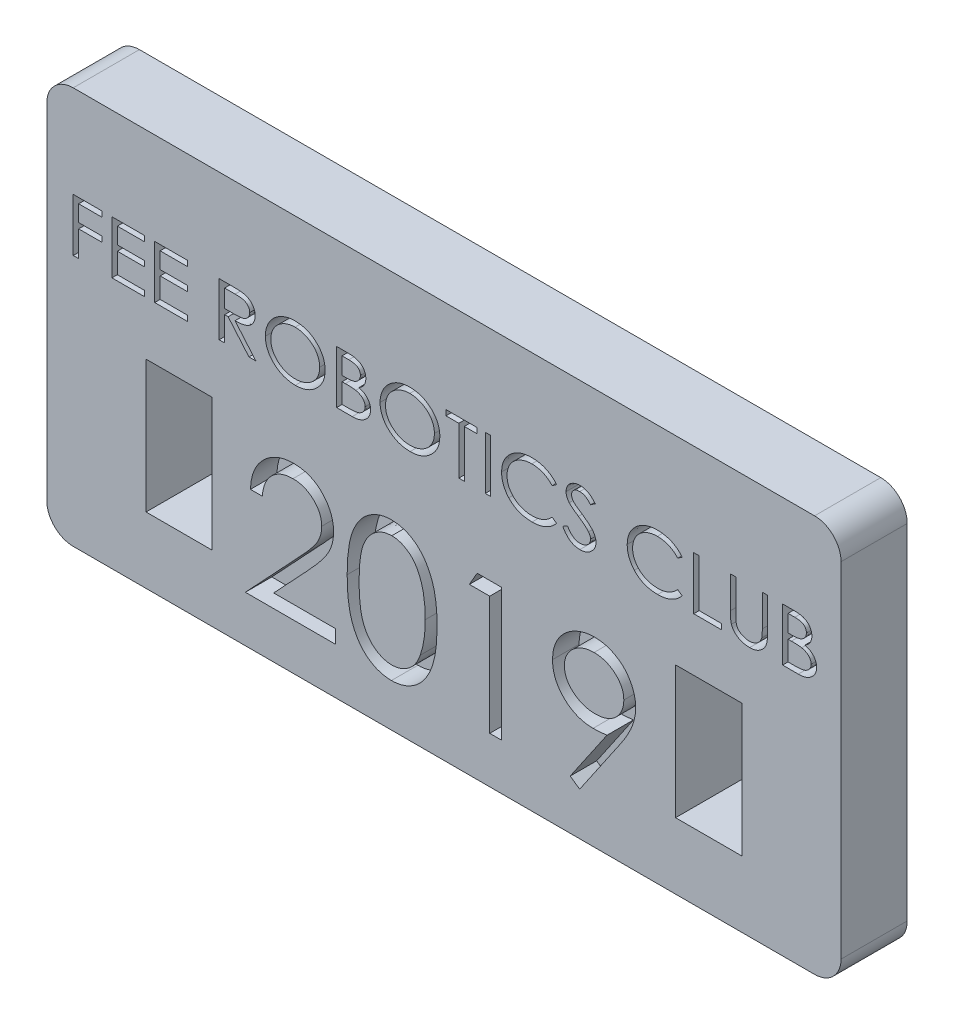
from build123d import *

# Parameters (mm, degrees)
SKETCH1_W           = 2.5
SKETCH1_H           = 5
BOSS_EXTRUDE1_DEPTH = 2.5
SKETCH3_W           = 0.205128205
SKETCH3_H           = 2
CUT_EXTRUDE2_DEPTH  = 1


with BuildPart() as part:
    # Sketch1 → Boss-Extrude1 (new body)
    with BuildSketch(Plane.XY):
        with BuildLine():
            Line((-14, -7.5), (14, -7.5))
            ThreePointArc((14, -7.5), (14.707106781, -7.207106781), (15, -6.5))
            Line((15, -6.5), (15, 6.5))
            ThreePointArc((15, 6.5), (14.707106781, 7.207106781), (14, 7.5))
            Line((14, 7.5), (-14, 7.5))
            ThreePointArc((-14, 7.5), (-14.707106781, 7.207106781), (-15, 6.5))
            Line((-15, 6.5), (-15, -6.5))
            ThreePointArc((-15, -6.5), (-14.707106781, -7.207106781), (-14, -7.5))
        make_face()
        with Locations((10, -2.5)):
            Rectangle(SKETCH1_W, SKETCH1_H, mode=Mode.SUBTRACT)
        with Locations((-10, -2.5)):
            Rectangle(SKETCH1_W, SKETCH1_H, mode=Mode.SUBTRACT)
    extrude(amount=BOSS_EXTRUDE1_DEPTH)

    # Sketch3 → Cut-Extrude2 (cut)
    # profile 1 of 19: a face of its own
    with BuildSketch(Plane.XY.offset(2.5)):
        Polygon((-14, 4.014689795), (-12.923076923, 4.014689795), (-12.923076923, 3.80956159), (-13.794871795, 3.80956159), (-13.794871795, 3.194176974), (-12.923076923, 3.194176974), (-12.923076923, 2.989048769), (-13.794871795, 2.989048769), (-13.794871795, 2.014689795), (-14, 2.014689795), align=None)
    # profile 2 of 19: a face of its own
    with BuildSketch(Plane.XY.offset(2.5)):
        Polygon((-12.538461538, 4.014689795), (-11.307692308, 4.014689795), (-11.307692308, 3.80956159), (-12.333333333, 3.80956159), (-12.333333333, 3.194176974), (-11.307692308, 3.194176974), (-11.307692308, 2.989048769), (-12.333333333, 2.989048769), (-12.333333333, 2.219818), (-11.307692308, 2.219818), (-11.307692308, 2.014689795), (-12.538461538, 2.014689795), align=None)
    # profile 3 of 19: a face of its own
    with BuildSketch(Plane.XY.offset(2.5)):
        Polygon((-10.923076923, 4.014689795), (-9.692307692, 4.014689795), (-9.692307692, 3.80956159), (-10.717948718, 3.80956159), (-10.717948718, 3.194176974), (-9.692307692, 3.194176974), (-9.692307692, 2.989048769), (-10.717948718, 2.989048769), (-10.717948718, 2.219818), (-9.692307692, 2.219818), (-9.692307692, 2.014689795), (-10.923076923, 2.014689795), align=None)
    # profile 4 of 19: a face of its own
    with BuildSketch(Plane.XY.offset(2.5)):
        with BuildLine():
            Line((-8.487179487, 4.014689795), (-8.054487179, 4.014689795))
            add(Edge.make_bspline(
                [(-8.054487179, 4.014689795), (-8.025507644, 4.014601518), (-7.969949668, 4.014432278), (-7.890337661, 4.01347452), (-7.818102558, 4.010755948), (-7.753153421, 4.008402278), (-7.695484088, 4.004101018), (-7.6450622, 4.000087358), (-7.601999071, 3.994621666), (-7.575969834, 3.989693197), (-7.564102564, 3.987446205)],
                knots=[0, 0, 0, 0, 1.414339765, 2.711494627, 3.88531881, 4.942159382, 5.882957806, 6.707302181, 7.410632199, 8, 8, 8, 8], degree=3))
            add(Edge.make_bspline(
                [(-7.564102564, 3.987446205), (-7.548270872, 3.983841997), (-7.51707105, 3.976739115), (-7.472061504, 3.961562145), (-7.42916048, 3.94405391), (-7.38842189, 3.923653771), (-7.350285111, 3.899760231), (-7.314159778, 3.873372242), (-7.280234704, 3.844029441), (-7.249328911, 3.811574696), (-7.220567222, 3.777251437), (-7.195861802, 3.740398306), (-7.174754746, 3.701706039), (-7.157950554, 3.660939814), (-7.144775633, 3.61841426), (-7.134980421, 3.573954877), (-7.12944394, 3.527517453), (-7.128621838, 3.495873728), (-7.128205128, 3.479834026)],
                knots=[0, 0, 0, 0, 1.069961787, 2.10859435, 3.127328182, 4.123628923, 5.108344377, 6.091089374, 7.071029513, 8.061202237, 9.043197423, 10.020086572, 10.981454588, 11.944635557, 12.92219912, 13.913584836, 14.942429197, 16, 16, 16, 16], degree=3))
            add(Edge.make_bspline(
                [(-7.128205128, 3.479834026), (-7.128401446, 3.466335665), (-7.128789155, 3.439677679), (-7.132911327, 3.400302769), (-7.139686989, 3.36228756), (-7.149106248, 3.325535169), (-7.160333049, 3.289783188), (-7.175640532, 3.255639288), (-7.192625408, 3.222432713), (-7.218958043, 3.179998018), (-7.258323661, 3.131042372), (-7.314746443, 3.079472499), (-7.380554096, 3.036067578), (-7.442055068, 3.006426055), (-7.49640408, 2.98718913), (-7.541240705, 2.973770066), (-7.59006987, 2.963270232), (-7.642431598, 2.953979077), (-7.698594825, 2.946877663), (-7.758469444, 2.94172309), (-7.822080502, 2.938500119), (-7.865781385, 2.938015541), (-7.888221154, 2.937766718)],
                knots=[0, 0, 0, 0, 0.765727938, 1.51224032, 2.243597852, 2.954892557, 3.664246923, 4.366767899, 5.075150103, 5.77963024, 7.197468406, 8.624290223, 10.099748923, 11.655498899, 12.484879315, 13.369704222, 14.309208053, 15.317126835, 16.386797013, 17.520226779, 18.72667245, 20, 20, 20, 20], degree=3))
            Line((-7.888221154, 2.937766718), (-7.102564103, 2.014689795))
            Line((-7.102564103, 2.014689795), (-7.36338141, 2.014689795))
            Line((-7.36338141, 2.014689795), (-8.149038462, 2.937766718))
            Line((-8.149038462, 2.937766718), (-8.282051282, 2.937766718))
            Line((-8.282051282, 2.937766718), (-8.282051282, 2.014689795))
            Line((-8.282051282, 2.014689795), (-8.487179487, 2.014689795))
            Line((-8.487179487, 2.014689795), (-8.487179487, 4.014689795))
        make_face()
        with BuildLine():
            Line((-8.282051282, 3.80956159), (-8.282051282, 3.142894923))
            Line((-8.282051282, 3.142894923), (-7.895032051, 3.140090436))
            add(Edge.make_bspline(
                [(-7.895032051, 3.140090436), (-7.876866709, 3.140082474), (-7.84172546, 3.140067073), (-7.790977014, 3.142341307), (-7.743803212, 3.144958856), (-7.700364697, 3.148897018), (-7.660526817, 3.154059532), (-7.624411079, 3.160398761), (-7.591877734, 3.167921652), (-7.55394307, 3.179400261), (-7.511554468, 3.197645239), (-7.465491384, 3.224169274), (-7.426333155, 3.257770336), (-7.392809863, 3.295752311), (-7.366507005, 3.33812327), (-7.347388523, 3.383385577), (-7.335158806, 3.430980182), (-7.333944828, 3.463735455), (-7.333333333, 3.480234667)],
                knots=[0, 0, 0, 0, 1.174785523, 2.272648088, 3.285089017, 4.230573644, 5.09306652, 5.882666545, 6.601326979, 7.251640612, 8.443701465, 9.578459247, 10.675607977, 11.765284551, 12.843880664, 13.885096452, 14.934698485, 16, 16, 16, 16], degree=3))
            add(Edge.make_bspline(
                [(-7.333333333, 3.480234667), (-7.334158657, 3.496321788), (-7.33579521, 3.528221315), (-7.347267335, 3.5749453), (-7.366844704, 3.619160879), (-7.393954861, 3.660138805), (-7.426352388, 3.697906688), (-7.464992258, 3.729605886), (-7.507859056, 3.756057845), (-7.547710865, 3.772861817), (-7.583361499, 3.78336208), (-7.61439971, 3.790449127), (-7.649572275, 3.796470656), (-7.688909159, 3.801054655), (-7.732313789, 3.805116142), (-7.779884776, 3.807837551), (-7.831452111, 3.809442132), (-7.867253, 3.809520798), (-7.885817308, 3.80956159)],
                knots=[0, 0, 0, 0, 1.061949867, 2.105764981, 3.156116539, 4.239743306, 5.339824676, 6.429463685, 7.526039854, 8.656250729, 9.272888371, 9.978850274, 10.757424844, 11.628143348, 12.593452775, 13.635925841, 14.774125383, 16, 16, 16, 16], degree=3))
            Line((-7.885817308, 3.80956159), (-8.282051282, 3.80956159))
        make_face(mode=Mode.SUBTRACT)
    # profile 5 of 19: a face of its own
    with BuildSketch(Plane.XY.offset(2.5)):
        with BuildLine():
            add(Edge.make_bspline(
                [(-5.629407051, 4.065971846), (-5.589573001, 4.065031185), (-5.511387508, 4.063184874), (-5.396631302, 4.049170052), (-5.287135712, 4.024679574), (-5.182031517, 3.992310132), (-5.082362413, 3.948990915), (-4.987545701, 3.896680963), (-4.897827445, 3.834588227), (-4.814008194, 3.763718552), (-4.737617467, 3.686279072), (-4.670269647, 3.603808695), (-4.614263233, 3.516256737), (-4.566931103, 3.425008325), (-4.53154129, 3.328619432), (-4.505621691, 3.228148333), (-4.490194832, 3.12320694), (-4.488194025, 3.05173298), (-4.487179487, 3.015491077)],
                knots=[0, 0, 0, 0, 1.104339174, 2.167575275, 3.19895946, 4.211974237, 5.212103104, 6.206540156, 7.210035823, 8.232212855, 9.245525355, 10.222267028, 11.178495095, 12.122427609, 13.066774007, 14.018748382, 14.995377748, 16, 16, 16, 16], degree=3))
            add(Edge.make_bspline(
                [(-4.487179487, 3.015491077), (-4.488189557, 2.979514406), (-4.490181414, 2.908568456), (-4.505689022, 2.804316016), (-4.531468506, 2.704322588), (-4.567257528, 2.608338242), (-4.61354782, 2.516532494), (-4.670610434, 2.429241044), (-4.737403384, 2.346023018), (-4.813587794, 2.26807134), (-4.896896572, 2.197025696), (-4.985607318, 2.134404902), (-5.078706477, 2.081177193), (-5.176863558, 2.038257406), (-5.279137668, 2.004329662), (-5.38618088, 1.980989636), (-5.497439046, 1.966024995), (-5.573268323, 1.964289254), (-5.611778846, 1.963407744)],
                knots=[0, 0, 0, 0, 1.006897034, 1.98559964, 2.943186421, 3.893189035, 4.847917768, 5.815452073, 6.80748931, 7.830684368, 8.862341799, 9.868509738, 10.866468422, 11.859160648, 12.862936224, 13.87796334, 14.922306222, 16, 16, 16, 16], degree=3))
            add(Edge.make_bspline(
                [(-5.611778846, 1.963407744), (-5.650689635, 1.964287833), (-5.727316487, 1.966020989), (-5.83989907, 1.981027845), (-5.947981229, 2.004255953), (-6.051285473, 2.037812634), (-6.149918252, 2.08086708), (-6.244049481, 2.133525648), (-6.333253728, 2.196008747), (-6.416792267, 2.266975491), (-6.49318523, 2.344278819), (-6.560338263, 2.426739238), (-6.616547011, 2.51369495), (-6.663048303, 2.604362342), (-6.699400275, 2.699010335), (-6.725001163, 2.797777133), (-6.740604934, 2.900543571), (-6.742585339, 2.970430875), (-6.743589744, 3.005875692)],
                knots=[0, 0, 0, 0, 1.090007837, 2.146547848, 3.177224824, 4.18441606, 5.184972819, 6.188625542, 7.201944888, 8.232227685, 9.256408654, 10.243626549, 11.2069681, 12.152656664, 13.094449289, 14.042142631, 15.007031417, 16, 16, 16, 16], degree=3))
            add(Edge.make_bspline(
                [(-6.743589744, 3.005875692), (-6.743098352, 3.0296625), (-6.742121853, 3.076931962), (-6.735183454, 3.147224537), (-6.723607998, 3.216315306), (-6.707081361, 3.284005317), (-6.686243067, 3.35045682), (-6.660493086, 3.415507987), (-6.630007875, 3.479175727), (-6.59508714, 3.541189619), (-6.556586626, 3.601088428), (-6.513876042, 3.657749172), (-6.467856034, 3.711047383), (-6.418346224, 3.760852629), (-6.365757873, 3.807426454), (-6.309870181, 3.85085104), (-6.250548038, 3.891050933), (-6.187680269, 3.92716036), (-6.122855273, 3.960093853), (-6.056013108, 3.98798579), (-5.988288973, 4.012222199), (-5.919100485, 4.031900484), (-5.848569244, 4.047156765), (-5.776685189, 4.05774568), (-5.703543604, 4.065072421), (-5.654265077, 4.065670268), (-5.629407051, 4.065971846)],
                knots=[0, 0, 0, 0, 1.000860702, 1.988923732, 2.969140983, 3.946405888, 4.918600368, 5.897447419, 6.887793071, 7.886663957, 8.890501988, 9.881803818, 10.869866848, 11.851371953, 12.834677219, 13.823874237, 14.827633617, 15.847405218, 16.872782081, 17.885187697, 18.892981817, 19.898014594, 20.909858577, 21.927149733, 22.954372848, 24, 24, 24, 24], degree=3))
        make_face()
        with BuildLine():
            add(Edge.make_bspline(
                [(-5.619791667, 3.860843641), (-5.639838967, 3.860612133), (-5.67974751, 3.860151266), (-5.739111126, 3.854085392), (-5.797733226, 3.845442737), (-5.855624113, 3.83311527), (-5.912579245, 3.816323901), (-5.969044777, 3.796965413), (-6.024531486, 3.773553261), (-6.07870606, 3.7466899), (-6.131419164, 3.717465616), (-6.181123994, 3.684924743), (-6.227781779, 3.649786362), (-6.271908205, 3.61273021), (-6.312860258, 3.572952889), (-6.350760857, 3.530658694), (-6.385543518, 3.485703449), (-6.417536012, 3.43868529), (-6.446022614, 3.389674356), (-6.471009358, 3.339163994), (-6.491827839, 3.287027476), (-6.508623627, 3.233543438), (-6.521917421, 3.178808691), (-6.531560373, 3.122741158), (-6.537234914, 3.065154215), (-6.538049487, 3.026320809), (-6.538461538, 3.006676974)],
                knots=[0, 0, 0, 0, 1.034314358, 2.059029303, 3.076765405, 4.092094375, 5.110880351, 6.139806059, 7.171636845, 8.216667878, 9.259764826, 10.280693852, 11.280175756, 12.273075775, 13.252873351, 14.224294354, 15.201858716, 16.184537379, 17.157522275, 18.125488912, 19.09060439, 20.051995777, 21.016643451, 21.995737629, 22.98614617, 24, 24, 24, 24], degree=3))
            add(Edge.make_bspline(
                [(-6.538461538, 3.006676974), (-6.53756633, 2.977790133), (-6.535804768, 2.920947583), (-6.523319033, 2.837428944), (-6.501746501, 2.757650591), (-6.472579145, 2.680853939), (-6.434098674, 2.607866221), (-6.387875156, 2.537890987), (-6.332338895, 2.472236093), (-6.269972423, 2.410014717), (-6.201222349, 2.3537915), (-6.128472654, 2.30422868), (-6.052261876, 2.262077965), (-5.972232798, 2.228253411), (-5.889103542, 2.200982246), (-5.802319761, 2.182540666), (-5.71229044, 2.170285127), (-5.650949943, 2.169125161), (-5.619791667, 2.168535949)],
                knots=[0, 0, 0, 0, 1.001985766, 1.97167371, 2.92126608, 3.864235468, 4.815363556, 5.777764185, 6.767768529, 7.793129838, 8.830022713, 9.843858898, 10.843270901, 11.845781331, 12.853757634, 13.873335827, 14.919748107, 16, 16, 16, 16], degree=3))
            add(Edge.make_bspline(
                [(-5.619791667, 2.168535949), (-5.598813773, 2.16880952), (-5.557192349, 2.169352302), (-5.495382094, 2.174745862), (-5.434763916, 2.183480028), (-5.375404679, 2.196007474), (-5.317238737, 2.211685695), (-5.260056856, 2.230321169), (-5.204469273, 2.253460526), (-5.150014424, 2.279252074), (-5.097835345, 2.308523041), (-5.047930983, 2.339978152), (-5.001446183, 2.374693334), (-4.957670423, 2.411449417), (-4.916952464, 2.450935924), (-4.879372496, 2.493105058), (-4.844243691, 2.537574183), (-4.812821246, 2.584908152), (-4.784334999, 2.633896331), (-4.759914529, 2.684610402), (-4.738931617, 2.736504291), (-4.721676141, 2.789759585), (-4.708397334, 2.844400207), (-4.699301985, 2.900398755), (-4.693520409, 2.957677695), (-4.692714159, 2.996380108), (-4.692307692, 3.015891718)],
                knots=[0, 0, 0, 0, 1.078057494, 2.138931934, 3.186396846, 4.224372019, 5.255081129, 6.281828204, 7.313085757, 8.34778727, 9.37721554, 10.386466275, 11.377698063, 12.356805186, 13.322831121, 14.290221845, 15.258318578, 16.233084811, 17.207971885, 18.168911637, 19.123652981, 20.083145109, 21.043790605, 22.010913397, 22.997212883, 24, 24, 24, 24], degree=3))
            add(Edge.make_bspline(
                [(-4.692307692, 3.015891718), (-4.692714355, 3.035269807), (-4.693520961, 3.073705741), (-4.699299003, 3.130585974), (-4.708407183, 3.186181381), (-4.721611732, 3.240312663), (-4.738941477, 3.29288273), (-4.759916511, 3.343979248), (-4.784350695, 3.393886912), (-4.81280674, 3.442096781), (-4.84439202, 3.488637717), (-4.879336293, 3.532832104), (-4.917525246, 3.574425012), (-4.958476695, 3.61408541), (-5.003034569, 3.650552744), (-5.050095677, 3.685491012), (-5.100628345, 3.717281105), (-5.153727011, 3.746833416), (-5.208658995, 3.773549812), (-5.264835363, 3.796873297), (-5.322018514, 3.816486617), (-5.379850005, 3.833032809), (-5.438771788, 3.845503333), (-5.4983446, 3.854045137), (-5.558767471, 3.860171042), (-5.599343369, 3.860618263), (-5.619791667, 3.860843641)],
                knots=[0, 0, 0, 0, 0.999618921, 1.982718035, 2.946629433, 3.904142108, 4.854089328, 5.799603779, 6.751722253, 7.718313886, 8.685273778, 9.65154614, 10.6220342, 11.596597958, 12.589904812, 13.590354425, 14.618671442, 15.667306976, 16.72423902, 17.768315198, 18.803281207, 19.841475733, 20.86981583, 21.90753015, 22.945496034, 24, 24, 24, 24], degree=3))
        make_face(mode=Mode.SUBTRACT)
    # profile 6 of 19: a face of its own
    with BuildSketch(Plane.XY.offset(2.5)):
        with BuildLine():
            Line((-4.051282051, 4.014689795), (-3.631810897, 4.014689795))
            add(Edge.make_bspline(
                [(-3.631810897, 4.014689795), (-3.611373992, 4.014584381), (-3.571547878, 4.014378957), (-3.513700783, 4.011401541), (-3.4594089, 4.007241535), (-3.408904348, 4.00074265), (-3.362087245, 3.992874772), (-3.318848103, 3.983274131), (-3.27925549, 3.971912213), (-3.232031266, 3.953701302), (-3.178194497, 3.926782519), (-3.119797112, 3.886747699), (-3.069160857, 3.83829909), (-3.026237655, 3.782848982), (-2.991955032, 3.722192117), (-2.966561382, 3.657571832), (-2.95134912, 3.589381521), (-2.949600687, 3.542676815), (-2.948717949, 3.519096846)],
                knots=[0, 0, 0, 0, 1.026537215, 2.000449073, 2.909141399, 3.761240825, 4.557558307, 5.293237899, 5.98532028, 6.624491679, 7.833606506, 9.000439915, 10.167774665, 11.33928532, 12.510930433, 13.655860955, 14.816506274, 16, 16, 16, 16], degree=3))
            add(Edge.make_bspline(
                [(-2.948717949, 3.519096846), (-2.949415861, 3.496997139), (-2.950789429, 3.453502484), (-2.963848474, 3.389940228), (-2.984183524, 3.329318049), (-3.013144323, 3.272181414), (-3.050396601, 3.21957196), (-3.094715971, 3.171136415), (-3.147838558, 3.128974788), (-3.187337008, 3.105578364), (-3.207532051, 3.093616077)],
                knots=[0, 0, 0, 0, 1.010534172, 1.988842405, 2.957379883, 3.930671019, 4.909265711, 5.899930093, 6.926261555, 8, 8, 8, 8], degree=3))
            add(Edge.make_bspline(
                [(-3.207532051, 3.093616077), (-3.181749238, 3.084916294), (-3.132613316, 3.068336573), (-3.064718904, 3.038754816), (-3.006050443, 3.006836431), (-2.956197677, 2.971959072), (-2.913943164, 2.933835598), (-2.876409142, 2.893132768), (-2.844522809, 2.848166777), (-2.817539094, 2.799808401), (-2.795861321, 2.748839815), (-2.780545587, 2.695154566), (-2.77113524, 2.639487533), (-2.769869059, 2.601531846), (-2.769230769, 2.582398128)],
                knots=[0, 0, 0, 0, 1.346938803, 2.566945604, 3.662061121, 4.64912261, 5.571723393, 6.47516609, 7.385335965, 8.294183634, 9.212865765, 10.121208085, 11.052888294, 12, 12, 12, 12], degree=3))
            add(Edge.make_bspline(
                [(-2.769230769, 2.582398128), (-2.76972035, 2.562865446), (-2.770684607, 2.524394702), (-2.779798128, 2.467948058), (-2.794557935, 2.413873207), (-2.815728406, 2.362261426), (-2.842316962, 2.312641627), (-2.874777648, 2.265182389), (-2.913854384, 2.220708087), (-2.957478849, 2.178166022), (-3.00675323, 2.14014797), (-3.059762948, 2.105892105), (-3.117484977, 2.078220811), (-3.178741418, 2.054626508), (-3.244268579, 2.036729414), (-3.31385729, 2.024185309), (-3.387347328, 2.015754744), (-3.437742565, 2.015050382), (-3.463541667, 2.014689795)],
                knots=[0, 0, 0, 0, 0.934016837, 1.839600048, 2.727906891, 3.610749874, 4.502726475, 5.417305507, 6.355074482, 7.33122427, 8.328254086, 9.328044487, 10.345425603, 11.385019735, 12.465559397, 13.589787999, 14.766127372, 16, 16, 16, 16], degree=3))
            Line((-3.463541667, 2.014689795), (-4.051282051, 2.014689795))
            Line((-4.051282051, 2.014689795), (-4.051282051, 4.014689795))
        make_face()
        with BuildLine():
            Line((-3.846153846, 3.80956159), (-3.846153846, 3.168535949))
            Line((-3.846153846, 3.168535949), (-3.721153846, 3.168535949))
            add(Edge.make_bspline(
                [(-3.721153846, 3.168535949), (-3.702724705, 3.16876452), (-3.667195319, 3.169205181), (-3.615867594, 3.170462184), (-3.568345672, 3.174016979), (-3.524580887, 3.177561083), (-3.484499213, 3.183323241), (-3.448313681, 3.190140096), (-3.415619354, 3.197353995), (-3.378039956, 3.209823213), (-3.335326492, 3.227812627), (-3.289767872, 3.256219522), (-3.249464894, 3.289723769), (-3.215500069, 3.328591016), (-3.188057212, 3.371504769), (-3.168360507, 3.41737083), (-3.156114774, 3.46571519), (-3.154610258, 3.498725844), (-3.153846154, 3.515491077)],
                knots=[0, 0, 0, 0, 1.179326401, 2.273613436, 3.284231698, 4.228051849, 5.082418279, 5.87346064, 6.584387835, 7.222117952, 8.404721211, 9.540556389, 10.644476126, 11.746542315, 12.829864912, 13.890161551, 14.928469205, 16, 16, 16, 16], degree=3))
            add(Edge.make_bspline(
                [(-3.153846154, 3.515491077), (-3.154156664, 3.52658907), (-3.154765765, 3.548358995), (-3.159462876, 3.580171369), (-3.168202092, 3.609980476), (-3.179147044, 3.638347028), (-3.194235122, 3.664482376), (-3.212472052, 3.688888743), (-3.234193363, 3.711140086), (-3.258877638, 3.731897081), (-3.287180616, 3.750425433), (-3.319404366, 3.766542446), (-3.355749555, 3.77935243), (-3.39563862, 3.790960348), (-3.439602605, 3.798757516), (-3.487266041, 3.805523345), (-3.538814481, 3.808870256), (-3.574515859, 3.809326189), (-3.592948718, 3.80956159)],
                knots=[0, 0, 0, 0, 0.890650758, 1.74710872, 2.571581619, 3.379658413, 4.181312168, 4.985184098, 5.819009381, 6.671231587, 7.569012546, 8.527685762, 9.555133466, 10.657868142, 11.858173333, 13.134505503, 14.520526182, 16, 16, 16, 16], degree=3))
            Line((-3.592948718, 3.80956159), (-3.846153846, 3.80956159))
        make_face(mode=Mode.SUBTRACT)
        with BuildLine():
            Line((-3.846153846, 2.963407744), (-3.846153846, 2.219818))
            Line((-3.846153846, 2.219818), (-3.574519231, 2.219818))
            add(Edge.make_bspline(
                [(-3.574519231, 2.219818), (-3.55515423, 2.220036432), (-3.517753549, 2.220458302), (-3.463637424, 2.221856922), (-3.413505229, 2.224930459), (-3.367463876, 2.229990365), (-3.325393171, 2.235159931), (-3.287464567, 2.242559654), (-3.253431082, 2.250767935), (-3.213721642, 2.263408964), (-3.169066732, 2.283206508), (-3.120957677, 2.313201545), (-3.077909203, 2.348505033), (-3.041637297, 2.389880117), (-3.012174307, 2.434832419), (-2.989776222, 2.482075099), (-2.977118652, 2.531799578), (-2.97528033, 2.565505129), (-2.974358974, 2.582398128)],
                knots=[0, 0, 0, 0, 1.180159444, 2.279306238, 3.298669569, 4.239650532, 5.101729713, 5.880625065, 6.593175785, 7.234034421, 8.418143755, 9.558574576, 10.679765258, 11.798294531, 12.897561832, 13.946260739, 14.970679439, 16, 16, 16, 16], degree=3))
            add(Edge.make_bspline(
                [(-2.974358974, 2.582398128), (-2.974702924, 2.592960556), (-2.975385087, 2.613909223), (-2.97973765, 2.644845341), (-2.987601073, 2.674676374), (-2.997713613, 2.703612234), (-3.011896852, 2.731093905), (-3.028072307, 2.758060022), (-3.047925412, 2.783643023), (-3.078222526, 2.816624246), (-3.122632962, 2.854149829), (-3.184926863, 2.891190443), (-3.25607942, 2.92068961), (-3.307480138, 2.933254332), (-3.334134615, 2.939769923)],
                knots=[0, 0, 0, 0, 0.690928633, 1.370332165, 2.037668789, 2.7063189, 3.370389162, 4.056497496, 4.760552431, 5.483850303, 6.983633847, 8.543048406, 10.207354999, 12, 12, 12, 12], degree=3))
            add(Edge.make_bspline(
                [(-3.334134615, 2.939769923), (-3.344267128, 2.941742338), (-3.3661746, 2.946006888), (-3.40190608, 2.950562314), (-3.442788005, 2.954576351), (-3.488898636, 2.957538922), (-3.540030471, 2.960610916), (-3.596418445, 2.961833977), (-3.657845676, 2.963247055), (-3.700586459, 2.963352861), (-3.72275641, 2.963407744)],
                knots=[0, 0, 0, 0, 0.635299181, 1.373578294, 2.21612843, 3.163814608, 4.217659813, 5.369052913, 6.635308885, 8, 8, 8, 8], degree=3))
            Line((-3.72275641, 2.963407744), (-3.846153846, 2.963407744))
        make_face(mode=Mode.SUBTRACT)
    # profile 7 of 19: a face of its own
    with BuildSketch(Plane.XY.offset(2.5)):
        with BuildLine():
            add(Edge.make_bspline(
                [(-1.296073718, 4.065971846), (-1.256239668, 4.065031185), (-1.178054175, 4.063184874), (-1.063297969, 4.049170052), (-0.953802379, 4.024679574), (-0.848698183, 3.992310132), (-0.74902908, 3.948990915), (-0.654212367, 3.896680963), (-0.564494112, 3.834588227), (-0.480674861, 3.763718552), (-0.404284134, 3.686279072), (-0.336936314, 3.603808695), (-0.2809299, 3.516256737), (-0.23359777, 3.425008325), (-0.198207957, 3.328619432), (-0.172288358, 3.228148333), (-0.156861498, 3.12320694), (-0.154860692, 3.05173298), (-0.153846154, 3.015491077)],
                knots=[0, 0, 0, 0, 1.104339174, 2.167575275, 3.19895946, 4.211974237, 5.212103104, 6.206540156, 7.210035823, 8.232212855, 9.245525355, 10.222267028, 11.178495095, 12.122427609, 13.066774007, 14.018748382, 14.995377748, 16, 16, 16, 16], degree=3))
            add(Edge.make_bspline(
                [(-0.153846154, 3.015491077), (-0.154856224, 2.979514406), (-0.15684808, 2.908568456), (-0.172355689, 2.804316016), (-0.198135173, 2.704322588), (-0.233924194, 2.608338242), (-0.280214487, 2.516532494), (-0.337277101, 2.429241044), (-0.404070051, 2.346023018), (-0.480254461, 2.26807134), (-0.563563238, 2.197025696), (-0.652273985, 2.134404902), (-0.745373144, 2.081177193), (-0.843530225, 2.038257406), (-0.945804335, 2.004329662), (-1.052847547, 1.980989636), (-1.164105712, 1.966024995), (-1.23993499, 1.964289254), (-1.278445513, 1.963407744)],
                knots=[0, 0, 0, 0, 1.006897034, 1.98559964, 2.943186421, 3.893189035, 4.847917768, 5.815452073, 6.80748931, 7.830684368, 8.862341799, 9.868509738, 10.866468422, 11.859160648, 12.862936224, 13.87796334, 14.922306222, 16, 16, 16, 16], degree=3))
            add(Edge.make_bspline(
                [(-1.278445513, 1.963407744), (-1.317356301, 1.964287833), (-1.393983154, 1.966020989), (-1.506565737, 1.981027845), (-1.614647896, 2.004255953), (-1.717952139, 2.037812634), (-1.816584919, 2.08086708), (-1.910716147, 2.133525648), (-1.999920394, 2.196008747), (-2.083458934, 2.266975491), (-2.159851897, 2.344278819), (-2.22700493, 2.426739238), (-2.283213678, 2.51369495), (-2.329714969, 2.604362342), (-2.366066942, 2.699010335), (-2.39166783, 2.797777133), (-2.407271601, 2.900543571), (-2.409252006, 2.970430875), (-2.41025641, 3.005875692)],
                knots=[0, 0, 0, 0, 1.090007837, 2.146547848, 3.177224824, 4.18441606, 5.184972819, 6.188625542, 7.201944888, 8.232227685, 9.256408654, 10.243626549, 11.2069681, 12.152656664, 13.094449289, 14.042142631, 15.007031417, 16, 16, 16, 16], degree=3))
            add(Edge.make_bspline(
                [(-2.41025641, 3.005875692), (-2.409765019, 3.0296625), (-2.40878852, 3.076931962), (-2.401850121, 3.147224537), (-2.390274665, 3.216315306), (-2.373748028, 3.284005317), (-2.352909734, 3.35045682), (-2.327159752, 3.415507987), (-2.296674542, 3.479175727), (-2.261753807, 3.541189619), (-2.223253293, 3.601088428), (-2.180542708, 3.657749172), (-2.134522701, 3.711047383), (-2.085012891, 3.760852629), (-2.032424539, 3.807426454), (-1.976536848, 3.85085104), (-1.917214705, 3.891050933), (-1.854346936, 3.92716036), (-1.78952194, 3.960093853), (-1.722679775, 3.98798579), (-1.654955639, 4.012222199), (-1.585767152, 4.031900484), (-1.515235911, 4.047156765), (-1.443351856, 4.05774568), (-1.370210271, 4.065072421), (-1.320931744, 4.065670268), (-1.296073718, 4.065971846)],
                knots=[0, 0, 0, 0, 1.000860702, 1.988923732, 2.969140983, 3.946405888, 4.918600368, 5.897447419, 6.887793071, 7.886663957, 8.890501988, 9.881803818, 10.869866848, 11.851371953, 12.834677219, 13.823874237, 14.827633617, 15.847405218, 16.872782081, 17.885187697, 18.892981817, 19.898014594, 20.909858577, 21.927149733, 22.954372848, 24, 24, 24, 24], degree=3))
        make_face()
        with BuildLine():
            add(Edge.make_bspline(
                [(-1.286458333, 3.860843641), (-1.306505634, 3.860612133), (-1.346414176, 3.860151266), (-1.405777792, 3.854085392), (-1.464399893, 3.845442737), (-1.522290779, 3.83311527), (-1.579245912, 3.816323901), (-1.635711443, 3.796965413), (-1.691198153, 3.773553261), (-1.745372727, 3.7466899), (-1.79808583, 3.717465616), (-1.847790661, 3.684924743), (-1.894448446, 3.649786362), (-1.938574872, 3.61273021), (-1.979526925, 3.572952889), (-2.017427524, 3.530658694), (-2.052210185, 3.485703449), (-2.084202679, 3.43868529), (-2.112689281, 3.389674356), (-2.137676025, 3.339163994), (-2.158494505, 3.287027476), (-2.175290294, 3.233543438), (-2.188584088, 3.178808691), (-2.19822704, 3.122741158), (-2.20390158, 3.065154215), (-2.204716154, 3.026320809), (-2.205128205, 3.006676974)],
                knots=[0, 0, 0, 0, 1.034314358, 2.059029303, 3.076765405, 4.092094375, 5.110880351, 6.139806059, 7.171636845, 8.216667878, 9.259764826, 10.280693852, 11.280175756, 12.273075775, 13.252873351, 14.224294354, 15.201858716, 16.184537379, 17.157522275, 18.125488912, 19.09060439, 20.051995777, 21.016643451, 21.995737629, 22.98614617, 24, 24, 24, 24], degree=3))
            add(Edge.make_bspline(
                [(-2.205128205, 3.006676974), (-2.204232996, 2.977790133), (-2.202471435, 2.920947583), (-2.1899857, 2.837428944), (-2.168413168, 2.757650591), (-2.139245812, 2.680853939), (-2.100765341, 2.607866221), (-2.054541822, 2.537890987), (-1.999005561, 2.472236093), (-1.93663909, 2.410014717), (-1.867889016, 2.3537915), (-1.79513932, 2.30422868), (-1.718928542, 2.262077965), (-1.638899465, 2.228253411), (-1.555770209, 2.200982246), (-1.468986428, 2.182540666), (-1.378957107, 2.170285127), (-1.317616609, 2.169125161), (-1.286458333, 2.168535949)],
                knots=[0, 0, 0, 0, 1.001985766, 1.97167371, 2.92126608, 3.864235468, 4.815363556, 5.777764185, 6.767768529, 7.793129838, 8.830022713, 9.843858898, 10.843270901, 11.845781331, 12.853757634, 13.873335827, 14.919748107, 16, 16, 16, 16], degree=3))
            add(Edge.make_bspline(
                [(-1.286458333, 2.168535949), (-1.265480439, 2.16880952), (-1.223859016, 2.169352302), (-1.16204876, 2.174745862), (-1.101430582, 2.183480028), (-1.042071346, 2.196007474), (-0.983905404, 2.211685695), (-0.926723523, 2.230321169), (-0.87113594, 2.253460526), (-0.816681091, 2.279252074), (-0.764502011, 2.308523041), (-0.71459765, 2.339978152), (-0.668112849, 2.374693334), (-0.62433709, 2.411449417), (-0.583619131, 2.450935924), (-0.546039163, 2.493105058), (-0.510910358, 2.537574183), (-0.479487913, 2.584908152), (-0.451001666, 2.633896331), (-0.426581196, 2.684610402), (-0.405598284, 2.736504291), (-0.388342807, 2.789759585), (-0.375064001, 2.844400207), (-0.365968652, 2.900398755), (-0.360187075, 2.957677695), (-0.359380825, 2.996380108), (-0.358974359, 3.015891718)],
                knots=[0, 0, 0, 0, 1.078057494, 2.138931934, 3.186396846, 4.224372019, 5.255081129, 6.281828204, 7.313085757, 8.34778727, 9.37721554, 10.386466275, 11.377698063, 12.356805186, 13.322831121, 14.290221845, 15.258318578, 16.233084811, 17.207971885, 18.168911637, 19.123652981, 20.083145109, 21.043790605, 22.010913397, 22.997212883, 24, 24, 24, 24], degree=3))
            add(Edge.make_bspline(
                [(-0.358974359, 3.015891718), (-0.359381022, 3.035269807), (-0.360187628, 3.073705741), (-0.36596567, 3.130585974), (-0.375073849, 3.186181381), (-0.388278399, 3.240312663), (-0.405608143, 3.29288273), (-0.426583177, 3.343979248), (-0.451017362, 3.393886912), (-0.479473406, 3.442096781), (-0.511058687, 3.488637717), (-0.54600296, 3.532832104), (-0.584191913, 3.574425012), (-0.625143361, 3.61408541), (-0.669701235, 3.650552744), (-0.716762344, 3.685491012), (-0.767295012, 3.717281105), (-0.820393678, 3.746833416), (-0.875325662, 3.773549812), (-0.931502029, 3.796873297), (-0.988685181, 3.816486617), (-1.046516672, 3.833032809), (-1.105438455, 3.845503333), (-1.165011267, 3.854045137), (-1.225434138, 3.860171042), (-1.266010036, 3.860618263), (-1.286458333, 3.860843641)],
                knots=[0, 0, 0, 0, 0.999618921, 1.982718035, 2.946629433, 3.904142108, 4.854089328, 5.799603779, 6.751722253, 7.718313886, 8.685273778, 9.65154614, 10.6220342, 11.596597958, 12.589904812, 13.590354425, 14.618671442, 15.667306976, 16.72423902, 17.768315198, 18.803281207, 19.841475733, 20.86981583, 21.90753015, 22.945496034, 24, 24, 24, 24], degree=3))
        make_face(mode=Mode.SUBTRACT)
    # profile 8 of 19: a face of its own
    with BuildSketch(Plane.XY.offset(2.5)):
        Polygon((0.076923077, 3.80956159), (0.076923077, 4.014689795), (1.256410256, 4.014689795), (1.256410256, 3.80956159), (0.769230769, 3.80956159), (0.769230769, 2.014689795), (0.564102564, 2.014689795), (0.564102564, 3.80956159), align=None)
    # profile 9 of 19: a face of its own
    with BuildSketch(Plane.XY.offset(2.5)):
        with Locations((1.666666667, 3.014689795)):
            Rectangle(SKETCH3_W, SKETCH3_H)
    # profile 10 of 19: a face of its own
    with BuildSketch(Plane.XY.offset(2.5)):
        with BuildLine():
            Line((4.256410256, 3.647702615), (4.086137821, 3.527510308))
            add(Edge.make_bspline(
                [(4.086137821, 3.527510308), (4.074410794, 3.540878169), (4.05103542, 3.567524206), (4.013219646, 3.604787442), (3.973548178, 3.639429765), (3.932697623, 3.672249337), (3.889585077, 3.70187473), (3.844729166, 3.729078259), (3.798185924, 3.753958402), (3.750026983, 3.776396699), (3.700455288, 3.796447203), (3.649602159, 3.813634558), (3.597548625, 3.828079158), (3.544367481, 3.840185331), (3.489758493, 3.849241806), (3.43403849, 3.856148906), (3.377065615, 3.86024578), (3.338681758, 3.860643119), (3.319310897, 3.860843641)],
                knots=[0, 0, 0, 0, 0.987988616, 1.969348707, 2.947476239, 3.914133475, 4.879650449, 5.852073906, 6.828228552, 7.81101881, 8.803290834, 9.798389771, 10.792353367, 11.804220729, 12.827885852, 13.867170163, 14.92364258, 16, 16, 16, 16], degree=3))
            add(Edge.make_bspline(
                [(3.319310897, 3.860843641), (3.298062521, 3.860613417), (3.255889519, 3.860156478), (3.193451436, 3.854137333), (3.132161656, 3.845461926), (3.072062994, 3.833068456), (3.013154249, 3.816864144), (2.955165147, 3.797860944), (2.898775872, 3.774319842), (2.843538541, 3.748103148), (2.790591316, 3.718588449), (2.74037917, 3.686530762), (2.693372973, 3.65203762), (2.649540775, 3.615012253), (2.608645263, 3.575629316), (2.570265736, 3.53413834), (2.536097163, 3.489317973), (2.504212666, 3.443044458), (2.476228264, 3.39447975), (2.451849179, 3.344371507), (2.430647386, 3.292850035), (2.414115853, 3.239534745), (2.400669375, 3.184991479), (2.391588331, 3.128847161), (2.385830424, 3.071300595), (2.385022618, 3.032331712), (2.384615385, 3.01268659)],
                knots=[0, 0, 0, 0, 1.086707936, 2.156858307, 3.206216814, 4.252746586, 5.293640676, 6.330738124, 7.372439178, 8.417607545, 9.457514494, 10.471510599, 11.463632715, 12.438189558, 13.404641288, 14.367051243, 15.326449106, 16.28536026, 17.240466584, 18.190795448, 19.134766207, 20.087719514, 21.043900528, 22.006528736, 22.995044709, 24, 24, 24, 24], degree=3))
            add(Edge.make_bspline(
                [(2.384615385, 3.01268659), (2.385270844, 2.983118216), (2.386558614, 2.925025781), (2.400117857, 2.839988163), (2.420463122, 2.758504687), (2.450767029, 2.681104503), (2.488313883, 2.607009905), (2.534881453, 2.536756638), (2.590067314, 2.470658686), (2.652768349, 2.408854942), (2.721794715, 2.352566103), (2.795905189, 2.303146475), (2.87479675, 2.261618664), (2.95783798, 2.227566405), (3.045294134, 2.200959606), (3.137198579, 2.18241301), (3.233383352, 2.17029655), (3.299107652, 2.169129472), (3.332532051, 2.168535949)],
                knots=[0, 0, 0, 0, 0.999772422, 1.964234346, 2.906881788, 3.836790166, 4.77055601, 5.713127618, 6.682331899, 7.679373438, 8.687982822, 9.691964788, 10.688596561, 11.699875298, 12.724904692, 13.776954569, 14.86945987, 16, 16, 16, 16], degree=3))
            add(Edge.make_bspline(
                [(3.332532051, 2.168535949), (3.369314388, 2.169503661), (3.441751176, 2.171409412), (3.547978359, 2.187461537), (3.649674006, 2.213471169), (3.746803977, 2.250177387), (3.839436204, 2.297238091), (3.927147953, 2.355037955), (4.010447687, 2.422986643), (4.060620343, 2.475275512), (4.086137821, 2.501869282)],
                knots=[0, 0, 0, 0, 1.038396361, 2.044951526, 3.026548194, 3.9981884, 4.971488998, 5.954852223, 6.959851486, 8, 8, 8, 8], degree=3))
            Line((4.086137821, 2.501869282), (4.256410256, 2.382878897))
            add(Edge.make_bspline(
                [(4.256410256, 2.382878897), (4.242985544, 2.366547319), (4.21611978, 2.333864285), (4.172454262, 2.28814019), (4.126626986, 2.244849254), (4.077907997, 2.204936193), (4.027224298, 2.167099543), (3.973682504, 2.132681053), (3.917916761, 2.100967639), (3.859885805, 2.072169104), (3.799772221, 2.046392869), (3.737580712, 2.024517281), (3.673795248, 2.005663789), (3.608314552, 1.989903988), (3.541012973, 1.977925272), (3.471980206, 1.969705625), (3.401265373, 1.964181285), (3.353509649, 1.963667776), (3.329326923, 1.963407744)],
                knots=[0, 0, 0, 0, 0.962555661, 1.926282818, 2.87723867, 3.831999293, 4.793016403, 5.756340418, 6.728780273, 7.713449941, 8.705362746, 9.70570582, 10.714151952, 11.733543913, 12.771528359, 13.82544641, 14.898841247, 16, 16, 16, 16], degree=3))
            add(Edge.make_bspline(
                [(3.329326923, 1.963407744), (3.306347713, 1.963554994), (3.261012347, 1.963845502), (3.194075916, 1.968654321), (3.128938835, 1.975192757), (3.065635906, 1.985055191), (3.00397712, 1.996618716), (2.944495058, 2.012255239), (2.886643456, 2.029714034), (2.830581898, 2.050132717), (2.77639199, 2.073372174), (2.72413087, 2.099539165), (2.673746878, 2.128358499), (2.625029215, 2.159731783), (2.578129676, 2.193736535), (2.533209013, 2.230691532), (2.490137965, 2.270435643), (2.463120981, 2.298858047), (2.449519231, 2.313167359)],
                knots=[0, 0, 0, 0, 1.12996279, 2.229288031, 3.299236407, 4.348972409, 5.379544523, 6.383222714, 7.372264321, 8.350978576, 9.316108783, 10.27081116, 11.224043633, 12.169664212, 13.119586762, 14.071641678, 15.029164452, 16, 16, 16, 16], degree=3))
            add(Edge.make_bspline(
                [(2.449519231, 2.313167359), (2.427902205, 2.338000299), (2.385084483, 2.387187913), (2.330415997, 2.467519817), (2.283335374, 2.551081664), (2.245844776, 2.63898119), (2.215881139, 2.730341681), (2.194700394, 2.825590636), (2.18212506, 2.924742353), (2.18037606, 2.992083924), (2.179487179, 3.026308385)],
                knots=[0, 0, 0, 0, 1.011003397, 2.002535507, 2.979952866, 3.954263469, 4.934133357, 5.930816142, 6.948395456, 8, 8, 8, 8], degree=3))
            add(Edge.make_bspline(
                [(2.179487179, 3.026308385), (2.180491136, 3.062285589), (2.182467249, 3.133100423), (2.198000396, 3.237087682), (2.223732903, 3.336558955), (2.259440166, 3.431817457), (2.306088748, 3.522394451), (2.362213928, 3.609035693), (2.429550378, 3.690559378), (2.505529367, 3.767484809), (2.589392008, 3.837364525), (2.679202368, 3.898961413), (2.77472415, 3.950059276), (2.874830316, 3.992992387), (2.98037181, 4.025875402), (3.091076293, 4.048864776), (3.206886089, 4.063265674), (3.285881405, 4.065058551), (3.326121795, 4.065971846)],
                knots=[0, 0, 0, 0, 0.999296999, 1.966941306, 2.913707878, 3.849592556, 4.787189525, 5.739176877, 6.712191726, 7.719721435, 8.739252801, 9.740634947, 10.740090377, 11.744245983, 12.762905952, 13.805749245, 14.882243776, 16, 16, 16, 16], degree=3))
            add(Edge.make_bspline(
                [(3.326121795, 4.065971846), (3.350570108, 4.065697588), (3.398989603, 4.065154424), (3.470805916, 4.059800291), (3.540858014, 4.050996345), (3.609045933, 4.038948064), (3.675511568, 4.023913766), (3.739882707, 4.004514467), (3.802586291, 3.982012155), (3.863412111, 3.956546994), (3.92189197, 3.927566077), (3.978053988, 3.896055984), (4.031282764, 3.86145444), (4.082160218, 3.824659266), (4.129655887, 3.78443964), (4.174883891, 3.741788241), (4.217314655, 3.696278529), (4.24338117, 3.663891132), (4.256410256, 3.647702615)],
                knots=[0, 0, 0, 0, 1.110059628, 2.198455433, 3.268087766, 4.314974337, 5.341802494, 6.360648324, 7.365811652, 8.365986546, 9.353207657, 10.32807642, 11.28857903, 12.234711145, 13.17735784, 14.112542603, 15.056573323, 16, 16, 16, 16], degree=3))
        make_face()
    # profile 11 of 19: a face of its own
    with BuildSketch(Plane.XY.offset(2.5)):
        with BuildLine():
            Line((4.487179487, 2.400507103), (4.670272436, 2.501869282))
            add(Edge.make_bspline(
                [(4.670272436, 2.501869282), (4.686607316, 2.47549272), (4.718029986, 2.424753319), (4.771213592, 2.356953996), (4.825677931, 2.29908192), (4.882079487, 2.251327464), (4.940925742, 2.214463611), (5.001750916, 2.187950266), (5.064708502, 2.171501384), (5.10754275, 2.169525858), (5.12900641, 2.168535949)],
                knots=[0, 0, 0, 0, 1.253021552, 2.410380904, 3.475470111, 4.460185, 5.388689421, 6.270994921, 7.133619014, 8, 8, 8, 8], degree=3))
            add(Edge.make_bspline(
                [(5.12900641, 2.168535949), (5.147340542, 2.169027306), (5.18369186, 2.170001528), (5.237143684, 2.1792389), (5.28895932, 2.193578517), (5.338169024, 2.214034121), (5.384157023, 2.238839922), (5.424769731, 2.268462129), (5.459449851, 2.302196149), (5.487909755, 2.339548617), (5.510343675, 2.37953101), (5.526474186, 2.42106625), (5.536679887, 2.463852103), (5.537864769, 2.492865555), (5.538461538, 2.507478256)],
                knots=[0, 0, 0, 0, 1.117334146, 2.215352634, 3.29837511, 4.390456354, 5.45848967, 6.478319752, 7.445976648, 8.398987977, 9.332517181, 10.232504492, 11.109796257, 12, 12, 12, 12], degree=3))
            add(Edge.make_bspline(
                [(5.538461538, 2.507478256), (5.537471449, 2.524130148), (5.53545737, 2.55800409), (5.520730962, 2.608121736), (5.496579639, 2.657592352), (5.474339311, 2.687956594), (5.462740385, 2.703792359)],
                knots=[0, 0, 0, 0, 0.931829012, 1.895563707, 2.902480149, 4, 4, 4, 4], degree=3))
            add(Edge.make_bspline(
                [(5.462740385, 2.703792359), (5.4532612, 2.71526334), (5.433309486, 2.739407371), (5.398940467, 2.775030604), (5.359036366, 2.812239124), (5.313977119, 2.851401552), (5.263137833, 2.891738701), (5.207496506, 2.934343867), (5.146138707, 2.978386819), (5.102906486, 3.00758777), (5.080528846, 3.022702615)],
                knots=[0, 0, 0, 0, 0.714762393, 1.504426282, 2.375974636, 3.335718653, 4.371867423, 5.493494949, 6.702595789, 8, 8, 8, 8], degree=3))
            add(Edge.make_bspline(
                [(5.080528846, 3.022702615), (5.058278471, 3.037676205), (5.015766959, 3.066284707), (4.956292285, 3.10900232), (4.902810069, 3.147564948), (4.856250984, 3.183484886), (4.81591064, 3.215494152), (4.782249286, 3.244509353), (4.755302833, 3.270292257), (4.740295917, 3.287175287), (4.733573718, 3.294737872)],
                knots=[0, 0, 0, 0, 1.456563732, 2.782907058, 3.976925193, 5.037437426, 5.976523114, 6.773507667, 7.450604967, 8, 8, 8, 8], degree=3))
            add(Edge.make_bspline(
                [(4.733573718, 3.294737872), (4.72417572, 3.306488025), (4.70575091, 3.329524245), (4.681667477, 3.365843325), (4.66082165, 3.402747861), (4.644848575, 3.440886), (4.631045146, 3.479212808), (4.621937344, 3.518606085), (4.616745127, 3.558754339), (4.615838542, 3.585722252), (4.615384615, 3.599225051)],
                knots=[0, 0, 0, 0, 1.082001755, 2.121268478, 3.131939468, 4.126079838, 5.092343318, 6.059513975, 7.028401166, 8, 8, 8, 8], degree=3))
            add(Edge.make_bspline(
                [(4.615384615, 3.599225051), (4.616244899, 3.620390058), (4.617948896, 3.66231242), (4.631155576, 3.72360795), (4.652627689, 3.781985177), (4.682288181, 3.837018026), (4.720229803, 3.887613431), (4.7651376, 3.93308656), (4.817450374, 3.972317578), (4.87555819, 4.005730982), (4.93876026, 4.032266049), (5.00499946, 4.052270101), (5.074271022, 4.063508622), (5.121222301, 4.065143018), (5.145032051, 4.065971846)],
                knots=[0, 0, 0, 0, 0.967956048, 1.917268652, 2.855042101, 3.806653596, 4.767386207, 5.739731228, 6.721252043, 7.750674316, 8.799524247, 9.851450016, 10.91043571, 12, 12, 12, 12], degree=3))
            add(Edge.make_bspline(
                [(5.145032051, 4.065971846), (5.170329684, 4.065280869), (5.220590458, 4.06390805), (5.294372427, 4.050508407), (5.365774446, 4.029595885), (5.423148054, 4.005041923), (5.468372136, 3.980825872), (5.502581687, 3.958413251), (5.537312226, 3.932654506), (5.573048881, 3.903999748), (5.608704234, 3.871287729), (5.644767901, 3.835048761), (5.68156444, 3.795533954), (5.705628881, 3.767449232), (5.717948718, 3.753071205)],
                knots=[0, 0, 0, 0, 1.343581969, 2.669398873, 3.972209689, 5.29212177, 5.978229007, 6.696944897, 7.463666474, 8.276335723, 9.130634109, 10.034185422, 10.993597435, 12, 12, 12, 12], degree=3))
            Line((5.717948718, 3.753071205), (5.542467949, 3.63007441))
            add(Edge.make_bspline(
                [(5.542467949, 3.63007441), (5.532100285, 3.641337611), (5.512010762, 3.663162427), (5.482101869, 3.694047319), (5.453093082, 3.721677996), (5.425638896, 3.746809183), (5.398672982, 3.768145757), (5.373545972, 3.787440221), (5.349063019, 3.802838405), (5.318675595, 3.820182356), (5.279947355, 3.836479037), (5.231857147, 3.850662009), (5.181663826, 3.859254851), (5.147468743, 3.860310692), (5.130208333, 3.860843641)],
                knots=[0, 0, 0, 0, 1.1264946, 2.182819734, 3.162837221, 4.074442579, 4.920099024, 5.692522356, 6.404030606, 7.046419284, 8.265828538, 9.484802126, 10.730421381, 12, 12, 12, 12], degree=3))
            add(Edge.make_bspline(
                [(5.130208333, 3.860843641), (5.108350428, 3.86015469), (5.066275124, 3.858828495), (5.006536445, 3.844289122), (4.952812078, 3.821433759), (4.913875087, 3.794265482), (4.886612692, 3.769473868), (4.869247497, 3.749324861), (4.853711604, 3.728797551), (4.841842096, 3.706327114), (4.831901671, 3.683260701), (4.825877782, 3.658723921), (4.820934996, 3.633609681), (4.820654355, 3.61634535), (4.820512821, 3.607638513)],
                knots=[0, 0, 0, 0, 1.760232571, 3.388353894, 4.927632624, 6.445876884, 7.19313098, 7.895540244, 8.589469407, 9.264487784, 9.940794775, 10.609853562, 11.298914165, 12, 12, 12, 12], degree=3))
            add(Edge.make_bspline(
                [(4.820512821, 3.607638513), (4.820923872, 3.596929771), (4.821746358, 3.575502292), (4.82763215, 3.543662717), (4.836803838, 3.512149279), (4.85034035, 3.480789797), (4.868715579, 3.448843742), (4.893607331, 3.416538079), (4.924275477, 3.382766779), (4.947617307, 3.360811758), (4.959935897, 3.349225051)],
                knots=[0, 0, 0, 0, 0.847316756, 1.695424412, 2.55504833, 3.440604087, 4.39250749, 5.464392083, 6.661839371, 8, 8, 8, 8], degree=3))
            add(Edge.make_bspline(
                [(4.959935897, 3.349225051), (4.964578424, 3.345312698), (4.975635377, 3.335994778), (4.9958218, 3.320942575), (5.022192943, 3.301931186), (5.054694051, 3.279026952), (5.093259676, 3.251945496), (5.138244508, 3.221721424), (5.189140376, 3.187090826), (5.225276579, 3.162901527), (5.244391026, 3.150106462)],
                knots=[0, 0, 0, 0, 0.419436643, 0.998958289, 1.739145775, 2.665983594, 3.746274523, 4.995278854, 6.410635948, 8, 8, 8, 8], degree=3))
            add(Edge.make_bspline(
                [(5.244391026, 3.150106462), (5.267455408, 3.134348266), (5.311980705, 3.103927406), (5.375092683, 3.0575885), (5.432849058, 3.012909136), (5.484859362, 2.969365898), (5.531253893, 2.927264291), (5.571796656, 2.886246891), (5.607331749, 2.846911753), (5.636816917, 2.807916547), (5.661938891, 2.769806746), (5.683681495, 2.732105648), (5.702174992, 2.694366781), (5.71753707, 2.65669248), (5.729390936, 2.618785026), (5.737018748, 2.580742031), (5.74282139, 2.542776295), (5.743333456, 2.517383054), (5.743589744, 2.504673769)],
                knots=[0, 0, 0, 0, 1.578022906, 3.046339409, 4.422727009, 5.702703616, 6.8776146, 7.96063192, 8.960000702, 9.869926452, 10.719515136, 11.53742413, 12.327003532, 13.091975727, 13.834173186, 14.566643069, 15.282606682, 16, 16, 16, 16], degree=3))
            add(Edge.make_bspline(
                [(5.743589744, 2.504673769), (5.74307282, 2.486741844), (5.742048593, 2.451211752), (5.733205193, 2.399011531), (5.719807648, 2.348330321), (5.699742502, 2.299771027), (5.674959196, 2.252612099), (5.6442257, 2.207540765), (5.607802521, 2.164505454), (5.566591451, 2.123813295), (5.521586855, 2.086173371), (5.473508467, 2.053392478), (5.423067275, 2.025315216), (5.370005944, 2.003089062), (5.314680503, 1.98521932), (5.257012268, 1.972514962), (5.196800934, 1.964620868), (5.155874148, 1.963817285), (5.135016026, 1.963407744)],
                knots=[0, 0, 0, 0, 0.951595583, 1.885479558, 2.80416064, 3.72995842, 4.668998158, 5.628881797, 6.620439808, 7.65848502, 8.700881629, 9.731609297, 10.744171855, 11.761046479, 12.781500572, 13.827629713, 14.892862811, 16, 16, 16, 16], degree=3))
            add(Edge.make_bspline(
                [(5.135016026, 1.963407744), (5.118841857, 1.963689956), (5.086954743, 1.964246333), (5.039755579, 1.969447331), (4.993587256, 1.976668487), (4.948716173, 1.988195912), (4.904761239, 2.002184098), (4.861962332, 2.019296591), (4.820445278, 2.040035038), (4.77984029, 2.063583257), (4.740188998, 2.091184642), (4.701469675, 2.122770197), (4.66359398, 2.158680348), (4.626882771, 2.199001925), (4.590264119, 2.243069139), (4.55475258, 2.291540949), (4.520165214, 2.344338713), (4.49837289, 2.381446877), (4.487179487, 2.400507103)],
                knots=[0, 0, 0, 0, 0.9415657, 1.856281696, 2.762794391, 3.66065843, 4.551013359, 5.447866327, 6.341746891, 7.251456702, 8.179140589, 9.152078792, 10.158839414, 11.215634977, 12.32593623, 13.494135372, 14.712888492, 16, 16, 16, 16], degree=3))
        make_face()
    # profile 12 of 19: a face of its own
    with BuildSketch(Plane.XY.offset(2.5)):
        with BuildLine():
            Line((9, 3.647702615), (8.829727564, 3.527510308))
            add(Edge.make_bspline(
                [(8.829727564, 3.527510308), (8.818000538, 3.540878169), (8.794625163, 3.567524206), (8.75680939, 3.604787442), (8.717137922, 3.639429765), (8.676287367, 3.672249337), (8.633174821, 3.70187473), (8.58831891, 3.729078259), (8.541775667, 3.753958402), (8.493616727, 3.776396699), (8.444045032, 3.796447203), (8.393191902, 3.813634558), (8.341138369, 3.828079158), (8.287957225, 3.840185331), (8.233348236, 3.849241806), (8.177628234, 3.856148906), (8.120655358, 3.86024578), (8.082271501, 3.860643119), (8.062900641, 3.860843641)],
                knots=[0, 0, 0, 0, 0.987988616, 1.969348707, 2.947476239, 3.914133475, 4.879650449, 5.852073906, 6.828228552, 7.81101881, 8.803290834, 9.798389771, 10.792353367, 11.804220729, 12.827885852, 13.867170163, 14.92364258, 16, 16, 16, 16], degree=3))
            add(Edge.make_bspline(
                [(8.062900641, 3.860843641), (8.041652265, 3.860613417), (7.999479262, 3.860156478), (7.93704118, 3.854137333), (7.875751399, 3.845461926), (7.815652738, 3.833068456), (7.756743992, 3.816864144), (7.698754891, 3.797860944), (7.642365615, 3.774319842), (7.587128285, 3.748103148), (7.53418106, 3.718588449), (7.483968913, 3.686530762), (7.436962717, 3.65203762), (7.393130518, 3.615012253), (7.352235006, 3.575629316), (7.31385548, 3.53413834), (7.279686907, 3.489317973), (7.247802409, 3.443044458), (7.219818008, 3.39447975), (7.195438922, 3.344371507), (7.174237129, 3.292850035), (7.157705597, 3.239534745), (7.144259118, 3.184991479), (7.135178075, 3.128847161), (7.129420168, 3.071300595), (7.128612362, 3.032331712), (7.128205128, 3.01268659)],
                knots=[0, 0, 0, 0, 1.086707936, 2.156858307, 3.206216814, 4.252746586, 5.293640676, 6.330738124, 7.372439178, 8.417607545, 9.457514494, 10.471510599, 11.463632715, 12.438189558, 13.404641288, 14.367051243, 15.326449106, 16.28536026, 17.240466584, 18.190795448, 19.134766207, 20.087719514, 21.043900528, 22.006528736, 22.995044709, 24, 24, 24, 24], degree=3))
            add(Edge.make_bspline(
                [(7.128205128, 3.01268659), (7.128860588, 2.983118216), (7.130148358, 2.925025781), (7.143707601, 2.839988163), (7.164052866, 2.758504687), (7.194356772, 2.681104503), (7.231903627, 2.607009905), (7.278471196, 2.536756638), (7.333657058, 2.470658686), (7.396358093, 2.408854942), (7.465384459, 2.352566103), (7.539494932, 2.303146475), (7.618386493, 2.261618664), (7.701427724, 2.227566405), (7.788883878, 2.200959606), (7.880788323, 2.18241301), (7.976973095, 2.17029655), (8.042697395, 2.169129472), (8.076121795, 2.168535949)],
                knots=[0, 0, 0, 0, 0.999772422, 1.964234346, 2.906881788, 3.836790166, 4.77055601, 5.713127618, 6.682331899, 7.679373438, 8.687982822, 9.691964788, 10.688596561, 11.699875298, 12.724904692, 13.776954569, 14.86945987, 16, 16, 16, 16], degree=3))
            add(Edge.make_bspline(
                [(8.076121795, 2.168535949), (8.112904132, 2.169503661), (8.185340919, 2.171409412), (8.291568103, 2.187461537), (8.393263749, 2.213471169), (8.490393721, 2.250177387), (8.583025947, 2.297238091), (8.670737696, 2.355037955), (8.754037431, 2.422986643), (8.804210086, 2.475275512), (8.829727564, 2.501869282)],
                knots=[0, 0, 0, 0, 1.038396361, 2.044951526, 3.026548194, 3.9981884, 4.971488998, 5.954852223, 6.959851486, 8, 8, 8, 8], degree=3))
            Line((8.829727564, 2.501869282), (9, 2.382878897))
            add(Edge.make_bspline(
                [(9, 2.382878897), (8.986575288, 2.366547319), (8.959709524, 2.333864285), (8.916044006, 2.28814019), (8.870216729, 2.244849254), (8.821497741, 2.204936193), (8.770814041, 2.167099543), (8.717272248, 2.132681053), (8.661506504, 2.100967639), (8.603475548, 2.072169104), (8.543361964, 2.046392869), (8.481170456, 2.024517281), (8.417384992, 2.005663789), (8.351904296, 1.989903988), (8.284602717, 1.977925272), (8.215569949, 1.969705625), (8.144855117, 1.964181285), (8.097099393, 1.963667776), (8.072916667, 1.963407744)],
                knots=[0, 0, 0, 0, 0.962555661, 1.926282818, 2.87723867, 3.831999293, 4.793016403, 5.756340418, 6.728780273, 7.713449941, 8.705362746, 9.70570582, 10.714151952, 11.733543913, 12.771528359, 13.82544641, 14.898841247, 16, 16, 16, 16], degree=3))
            add(Edge.make_bspline(
                [(8.072916667, 1.963407744), (8.049937457, 1.963554994), (8.004602091, 1.963845502), (7.937665659, 1.968654321), (7.872528579, 1.975192757), (7.80922565, 1.985055191), (7.747566863, 1.996618716), (7.688084802, 2.012255239), (7.630233199, 2.029714034), (7.574171642, 2.050132717), (7.519981734, 2.073372174), (7.467720613, 2.099539165), (7.417336621, 2.128358499), (7.368618958, 2.159731783), (7.32171942, 2.193736535), (7.276798757, 2.230691532), (7.233727709, 2.270435643), (7.206710725, 2.298858047), (7.193108974, 2.313167359)],
                knots=[0, 0, 0, 0, 1.12996279, 2.229288031, 3.299236407, 4.348972409, 5.379544523, 6.383222714, 7.372264321, 8.350978576, 9.316108783, 10.27081116, 11.224043633, 12.169664212, 13.119586762, 14.071641678, 15.029164452, 16, 16, 16, 16], degree=3))
            add(Edge.make_bspline(
                [(7.193108974, 2.313167359), (7.171491948, 2.338000299), (7.128674226, 2.387187913), (7.07400574, 2.467519817), (7.026925118, 2.551081664), (6.98943452, 2.63898119), (6.959470883, 2.730341681), (6.938290138, 2.825590636), (6.925714803, 2.924742353), (6.923965803, 2.992083924), (6.923076923, 3.026308385)],
                knots=[0, 0, 0, 0, 1.011003397, 2.002535507, 2.979952866, 3.954263469, 4.934133357, 5.930816142, 6.948395456, 8, 8, 8, 8], degree=3))
            add(Edge.make_bspline(
                [(6.923076923, 3.026308385), (6.92408088, 3.062285589), (6.926056993, 3.133100423), (6.94159014, 3.237087682), (6.967322646, 3.336558955), (7.00302991, 3.431817457), (7.049678491, 3.522394451), (7.105803672, 3.609035693), (7.173140122, 3.690559378), (7.24911911, 3.767484809), (7.332981752, 3.837364525), (7.422792111, 3.898961413), (7.518313893, 3.950059276), (7.61842006, 3.992992387), (7.723961554, 4.025875402), (7.834666037, 4.048864776), (7.950475832, 4.063265674), (8.029471148, 4.065058551), (8.069711538, 4.065971846)],
                knots=[0, 0, 0, 0, 0.999296999, 1.966941306, 2.913707878, 3.849592556, 4.787189525, 5.739176877, 6.712191726, 7.719721435, 8.739252801, 9.740634947, 10.740090377, 11.744245983, 12.762905952, 13.805749245, 14.882243776, 16, 16, 16, 16], degree=3))
            add(Edge.make_bspline(
                [(8.069711538, 4.065971846), (8.094159852, 4.065697588), (8.142579347, 4.065154424), (8.21439566, 4.059800291), (8.284447757, 4.050996345), (8.352635676, 4.038948064), (8.419101312, 4.023913766), (8.48347245, 4.004514467), (8.546176035, 3.982012155), (8.607001855, 3.956546994), (8.665481714, 3.927566077), (8.721643732, 3.896055984), (8.774872508, 3.86145444), (8.825749961, 3.824659266), (8.873245631, 3.78443964), (8.918473634, 3.741788241), (8.960904399, 3.696278529), (8.986970914, 3.663891132), (9, 3.647702615)],
                knots=[0, 0, 0, 0, 1.110059628, 2.198455433, 3.268087766, 4.314974337, 5.341802494, 6.360648324, 7.365811652, 8.365986546, 9.353207657, 10.32807642, 11.28857903, 12.234711145, 13.17735784, 14.112542603, 15.056573323, 16, 16, 16, 16], degree=3))
        make_face()
    # profile 13 of 19: a face of its own
    with BuildSketch(Plane.XY.offset(2.5)):
        Polygon((9.435897436, 4.014689795), (9.641025641, 4.014689795), (9.641025641, 2.219818), (10.487179487, 2.219818), (10.487179487, 2.014689795), (9.435897436, 2.014689795), align=None)
    # profile 14 of 19: a face of its own
    with BuildSketch(Plane.XY.offset(2.5)):
        with BuildLine():
            Line((10.820512821, 4.014689795), (11.025641026, 4.014689795))
            Line((11.025641026, 4.014689795), (11.025641026, 2.816372487))
            add(Edge.make_bspline(
                [(11.025641026, 2.816372487), (11.025608945, 2.79941193), (11.025548068, 2.767226349), (11.025954708, 2.72141763), (11.026685259, 2.680681201), (11.027950664, 2.644893728), (11.029218319, 2.614183174), (11.030085385, 2.588365124), (11.03215145, 2.56767245), (11.033763044, 2.555551905), (11.034455128, 2.550346846)],
                knots=[0, 0, 0, 0, 1.528365921, 2.900337718, 4.128080151, 5.199748041, 6.127098136, 6.898143988, 7.526817833, 8, 8, 8, 8], degree=3))
            add(Edge.make_bspline(
                [(11.034455128, 2.550346846), (11.037636361, 2.531557286), (11.043831029, 2.494969246), (11.059918839, 2.443117897), (11.081312664, 2.395911241), (11.108343738, 2.353112397), (11.142664892, 2.31459913), (11.184268293, 2.279548512), (11.234273392, 2.248622366), (11.29019437, 2.220510987), (11.350444225, 2.197882116), (11.41205545, 2.18076832), (11.474002368, 2.170341513), (11.515453127, 2.16913546), (11.536057692, 2.168535949)],
                knots=[0, 0, 0, 0, 0.990785618, 1.929310969, 2.815545606, 3.681078504, 4.552477416, 5.489380645, 6.501479031, 7.604706424, 8.741731925, 9.844258773, 10.928412568, 12, 12, 12, 12], degree=3))
            add(Edge.make_bspline(
                [(11.536057692, 2.168535949), (11.553841879, 2.169143483), (11.589169502, 2.170350328), (11.641621391, 2.177951954), (11.692603545, 2.191516117), (11.742356805, 2.209194055), (11.78908574, 2.23253511), (11.832929263, 2.259111352), (11.871810134, 2.290933619), (11.907427572, 2.325685319), (11.938604211, 2.364944298), (11.964741376, 2.408351481), (11.987428953, 2.455296351), (11.998131664, 2.488760048), (12.003605769, 2.505875692)],
                knots=[0, 0, 0, 0, 1.032640493, 2.051301782, 3.068693452, 4.091477462, 5.110935144, 6.096359796, 7.06144262, 8.020902826, 8.981145921, 9.96250531, 10.957884612, 12, 12, 12, 12], degree=3))
            add(Edge.make_bspline(
                [(12.003605769, 2.505875692), (12.005459489, 2.512928982), (12.009586083, 2.528630415), (12.013523063, 2.555232014), (12.017748868, 2.586574993), (12.020196879, 2.622981453), (12.022610647, 2.66424406), (12.024790009, 2.710582267), (12.025279349, 2.761884725), (12.025516925, 2.797676272), (12.025641026, 2.816372487)],
                knots=[0, 0, 0, 0, 0.560648202, 1.248067364, 2.066168439, 2.993596529, 4.053584458, 5.246443539, 6.561641311, 8, 8, 8, 8], degree=3))
            Line((12.025641026, 2.816372487), (12.025641026, 4.014689795))
            Line((12.025641026, 4.014689795), (12.230769231, 4.014689795))
            Line((12.230769231, 4.014689795), (12.230769231, 2.806757103))
            add(Edge.make_bspline(
                [(12.230769231, 2.806757103), (12.230662768, 2.784985124), (12.230454971, 2.742490189), (12.227458133, 2.680237752), (12.223205275, 2.62117134), (12.217154647, 2.565321751), (12.209770808, 2.512731829), (12.199966048, 2.463329703), (12.189074596, 2.416941403), (12.175677999, 2.373586503), (12.160070738, 2.332402986), (12.140556529, 2.29318656), (12.118344797, 2.254766172), (12.091355213, 2.218438462), (12.062084714, 2.182724382), (12.02864044, 2.148778239), (11.991953101, 2.116152394), (11.952148066, 2.084932505), (11.909454933, 2.056600015), (11.864343069, 2.031602568), (11.816964733, 2.010258001), (11.767194736, 1.99306078), (11.715285805, 1.979946605), (11.661361316, 1.970204164), (11.605085925, 1.964622544), (11.566785564, 1.963817717), (11.547275641, 1.963407744)],
                knots=[0, 0, 0, 0, 1.265394352, 2.469819253, 3.621848637, 4.707110508, 5.734647429, 6.707449683, 7.633768727, 8.502968752, 9.343408254, 10.19048939, 11.046521868, 11.919146747, 12.817628738, 13.728863348, 14.685519551, 15.669989877, 16.666808001, 17.6605384, 18.664674321, 19.683465587, 20.717083353, 21.773819939, 22.866000193, 24, 24, 24, 24], degree=3))
            add(Edge.make_bspline(
                [(11.547275641, 1.963407744), (11.52616763, 1.963859462), (11.484689242, 1.964747113), (11.423604972, 1.969750167), (11.364952917, 1.979294054), (11.308295026, 1.991293908), (11.254234611, 2.008063008), (11.20216209, 2.027398336), (11.15288682, 2.051446991), (11.105647157, 2.077936326), (11.061748383, 2.107917787), (11.021458924, 2.140524156), (10.984831373, 2.175465119), (10.951990892, 2.212720658), (10.922690927, 2.2522109), (10.898118627, 2.294481779), (10.876451326, 2.338698578), (10.865363661, 2.369672396), (10.859775641, 2.385282744)],
                knots=[0, 0, 0, 0, 1.173445837, 2.305884778, 3.403031309, 4.47469448, 5.522017405, 6.546359194, 7.559014859, 8.566296426, 9.554580352, 10.509862999, 11.444414508, 12.3647961, 13.267495868, 14.17266449, 15.079049819, 16, 16, 16, 16], degree=3))
            add(Edge.make_bspline(
                [(10.859775641, 2.385282744), (10.85653977, 2.395924092), (10.849529945, 2.418976305), (10.841933863, 2.45722335), (10.835053326, 2.501177385), (10.830212472, 2.551099092), (10.825725518, 2.606648791), (10.822493239, 2.668101164), (10.821158996, 2.735437241), (10.820734247, 2.782317746), (10.820512821, 2.806757103)],
                knots=[0, 0, 0, 0, 0.628224746, 1.360915039, 2.200951013, 3.141919593, 4.194245416, 5.350528196, 6.618799321, 8, 8, 8, 8], degree=3))
            Line((10.820512821, 2.806757103), (10.820512821, 4.014689795))
        make_face()
    # profile 15 of 19: a face of its own
    with BuildSketch(Plane.XY.offset(2.5)):
        with BuildLine():
            Line((12.794871795, 4.014689795), (13.214342949, 4.014689795))
            add(Edge.make_bspline(
                [(13.214342949, 4.014689795), (13.234779854, 4.014584381), (13.274605968, 4.014378957), (13.332453063, 4.011401541), (13.386744946, 4.007241535), (13.437249498, 4.00074265), (13.484066601, 3.992874772), (13.527305743, 3.983274131), (13.566898356, 3.971912213), (13.61412258, 3.953701302), (13.667959349, 3.926782519), (13.726356734, 3.886747699), (13.776992989, 3.83829909), (13.819916191, 3.782848982), (13.854198815, 3.722192117), (13.879592464, 3.657571832), (13.894804726, 3.589381521), (13.89655316, 3.542676815), (13.897435897, 3.519096846)],
                knots=[0, 0, 0, 0, 1.026537215, 2.000449073, 2.909141399, 3.761240825, 4.557558307, 5.293237899, 5.98532028, 6.624491679, 7.833606506, 9.000439915, 10.167774665, 11.33928532, 12.510930433, 13.655860955, 14.816506274, 16, 16, 16, 16], degree=3))
            add(Edge.make_bspline(
                [(13.897435897, 3.519096846), (13.896737985, 3.496997139), (13.895364417, 3.453502484), (13.882305372, 3.389940228), (13.861970322, 3.329318049), (13.833009523, 3.272181414), (13.795757245, 3.21957196), (13.751437875, 3.171136415), (13.698315288, 3.128974788), (13.658816839, 3.105578364), (13.638621795, 3.093616077)],
                knots=[0, 0, 0, 0, 1.010534172, 1.988842405, 2.957379883, 3.930671019, 4.909265711, 5.899930093, 6.926261555, 8, 8, 8, 8], degree=3))
            add(Edge.make_bspline(
                [(13.638621795, 3.093616077), (13.664404608, 3.084916294), (13.71354053, 3.068336573), (13.781434942, 3.038754816), (13.840103403, 3.006836431), (13.88995617, 2.971959072), (13.932210683, 2.933835598), (13.969744704, 2.893132768), (14.001631037, 2.848166777), (14.028614753, 2.799808401), (14.050292525, 2.748839815), (14.065608259, 2.695154566), (14.075018606, 2.639487533), (14.076284787, 2.601531846), (14.076923077, 2.582398128)],
                knots=[0, 0, 0, 0, 1.346938803, 2.566945604, 3.662061121, 4.64912261, 5.571723393, 6.47516609, 7.385335965, 8.294183634, 9.212865765, 10.121208085, 11.052888294, 12, 12, 12, 12], degree=3))
            add(Edge.make_bspline(
                [(14.076923077, 2.582398128), (14.076433496, 2.562865446), (14.075469239, 2.524394702), (14.066355718, 2.467948058), (14.051595912, 2.413873207), (14.03042544, 2.362261426), (14.003836885, 2.312641627), (13.971376198, 2.265182389), (13.932299462, 2.220708087), (13.888674997, 2.178166022), (13.839400616, 2.14014797), (13.786390898, 2.105892105), (13.72866887, 2.078220811), (13.667412428, 2.054626508), (13.601885267, 2.036729414), (13.532296556, 2.024185309), (13.458806518, 2.015754744), (13.408411281, 2.015050382), (13.382612179, 2.014689795)],
                knots=[0, 0, 0, 0, 0.934016837, 1.839600048, 2.727906891, 3.610749874, 4.502726475, 5.417305507, 6.355074482, 7.33122427, 8.328254086, 9.328044487, 10.345425603, 11.385019735, 12.465559397, 13.589787999, 14.766127372, 16, 16, 16, 16], degree=3))
            Line((13.382612179, 2.014689795), (12.794871795, 2.014689795))
            Line((12.794871795, 2.014689795), (12.794871795, 4.014689795))
        make_face()
        with BuildLine():
            Line((13, 3.80956159), (13, 3.168535949))
            Line((13, 3.168535949), (13.125, 3.168535949))
            add(Edge.make_bspline(
                [(13.125, 3.168535949), (13.143429141, 3.16876452), (13.178958527, 3.169205181), (13.230286252, 3.170462184), (13.277808174, 3.174016979), (13.321572959, 3.177561083), (13.361654633, 3.183323241), (13.397840165, 3.190140096), (13.430534493, 3.197353995), (13.46811389, 3.209823213), (13.510827354, 3.227812627), (13.556385974, 3.256219522), (13.596688952, 3.289723769), (13.630653777, 3.328591016), (13.658096634, 3.371504769), (13.677793339, 3.41737083), (13.690039072, 3.46571519), (13.691543588, 3.498725844), (13.692307692, 3.515491077)],
                knots=[0, 0, 0, 0, 1.179326401, 2.273613436, 3.284231698, 4.228051849, 5.082418279, 5.87346064, 6.584387835, 7.222117952, 8.404721211, 9.540556389, 10.644476126, 11.746542315, 12.829864912, 13.890161551, 14.928469205, 16, 16, 16, 16], degree=3))
            add(Edge.make_bspline(
                [(13.692307692, 3.515491077), (13.691997182, 3.52658907), (13.691388082, 3.548358995), (13.68669097, 3.580171369), (13.677951755, 3.609980476), (13.667006803, 3.638347028), (13.651918724, 3.664482376), (13.633681794, 3.688888743), (13.611960484, 3.711140086), (13.587276208, 3.731897081), (13.55897323, 3.750425433), (13.52674948, 3.766542446), (13.490404291, 3.77935243), (13.450515226, 3.790960348), (13.406551242, 3.798757516), (13.358887805, 3.805523345), (13.307339366, 3.808870256), (13.271637987, 3.809326189), (13.253205128, 3.80956159)],
                knots=[0, 0, 0, 0, 0.890650758, 1.74710872, 2.571581619, 3.379658413, 4.181312168, 4.985184098, 5.819009381, 6.671231587, 7.569012546, 8.527685762, 9.555133466, 10.657868142, 11.858173333, 13.134505503, 14.520526182, 16, 16, 16, 16], degree=3))
            Line((13.253205128, 3.80956159), (13, 3.80956159))
        make_face(mode=Mode.SUBTRACT)
        with BuildLine():
            Line((13, 2.963407744), (13, 2.219818))
            Line((13, 2.219818), (13.271634615, 2.219818))
            add(Edge.make_bspline(
                [(13.271634615, 2.219818), (13.290999616, 2.220036432), (13.328400297, 2.220458302), (13.382516423, 2.221856922), (13.432648617, 2.224930459), (13.47868997, 2.229990365), (13.520760675, 2.235159931), (13.558689279, 2.242559654), (13.592722764, 2.250767935), (13.632432205, 2.263408964), (13.677087114, 2.283206508), (13.725196169, 2.313201545), (13.768244643, 2.348505033), (13.804516549, 2.389880117), (13.833979539, 2.434832419), (13.856377624, 2.482075099), (13.869035194, 2.531799578), (13.870873517, 2.565505129), (13.871794872, 2.582398128)],
                knots=[0, 0, 0, 0, 1.180159444, 2.279306238, 3.298669569, 4.239650532, 5.101729713, 5.880625065, 6.593175785, 7.234034421, 8.418143755, 9.558574576, 10.679765258, 11.798294531, 12.897561832, 13.946260739, 14.970679439, 16, 16, 16, 16], degree=3))
            add(Edge.make_bspline(
                [(13.871794872, 2.582398128), (13.871450922, 2.592960556), (13.870768759, 2.613909223), (13.866416196, 2.644845341), (13.858552773, 2.674676374), (13.848440233, 2.703612234), (13.834256994, 2.731093905), (13.81808154, 2.758060022), (13.798228435, 2.783643023), (13.767931321, 2.816624246), (13.723520884, 2.854149829), (13.661226983, 2.891190443), (13.590074426, 2.92068961), (13.538673708, 2.933254332), (13.512019231, 2.939769923)],
                knots=[0, 0, 0, 0, 0.690928633, 1.370332165, 2.037668789, 2.7063189, 3.370389162, 4.056497496, 4.760552431, 5.483850303, 6.983633847, 8.543048406, 10.207354999, 12, 12, 12, 12], degree=3))
            add(Edge.make_bspline(
                [(13.512019231, 2.939769923), (13.501886718, 2.941742338), (13.479979246, 2.946006888), (13.444247766, 2.950562314), (13.403365841, 2.954576351), (13.35725521, 2.957538922), (13.306123375, 2.960610916), (13.249735401, 2.961833977), (13.18830817, 2.963247055), (13.145567387, 2.963352861), (13.123397436, 2.963407744)],
                knots=[0, 0, 0, 0, 0.635299181, 1.373578294, 2.21612843, 3.163814608, 4.217659813, 5.369052913, 6.635308885, 8, 8, 8, 8], degree=3))
            Line((13.123397436, 2.963407744), (13, 2.963407744))
        make_face(mode=Mode.SUBTRACT)
    # profile 16 of 19: a face of its own
    with BuildSketch(Plane.XY.offset(2.5)):
        with BuildLine():
            Line((-6.858974359, -2.288176266), (-7.307692308, -2.288176266))
            add(Edge.make_bspline(
                [(-7.307692308, -2.288176266), (-7.304767803, -2.228646426), (-7.299024155, -2.111731405), (-7.272126599, -1.941268682), (-7.233639631, -1.778333255), (-7.179223268, -1.624233378), (-7.111642872, -1.477606511), (-7.030599975, -1.33903506), (-6.93460876, -1.209047647), (-6.825741997, -1.0888493), (-6.707501084, -0.978581341), (-6.579921171, -0.883359566), (-6.445856846, -0.80290575), (-6.305714848, -0.735646833), (-6.157914043, -0.685161338), (-6.003795674, -0.647701853), (-5.842682622, -0.625164217), (-5.732911162, -0.622741666), (-5.677083333, -0.621509599)],
                knots=[0, 0, 0, 0, 1.10065271, 2.161652631, 3.183658789, 4.190468796, 5.17591951, 6.163126047, 7.15150782, 8.156236427, 9.156009102, 10.134482811, 11.092018607, 12.041330605, 13.001268258, 13.972401359, 14.968799086, 16, 16, 16, 16], degree=3))
            add(Edge.make_bspline(
                [(-5.677083333, -0.621509599), (-5.622257513, -0.622793108), (-5.514526735, -0.625315158), (-5.357295286, -0.646973771), (-5.207613437, -0.680896045), (-5.06577377, -0.728489497), (-4.932907964, -0.79246725), (-4.8080179, -0.869320877), (-4.689616742, -0.95820635), (-4.583035622, -1.062854655), (-4.485166938, -1.174572347), (-4.400735145, -1.293840781), (-4.328430625, -1.417025475), (-4.268162511, -1.545065763), (-4.223796598, -1.679167232), (-4.190113444, -1.817377522), (-4.171074282, -1.961127252), (-4.168152248, -2.058422331), (-4.166666667, -2.107887804)],
                knots=[0, 0, 0, 0, 1.111607364, 2.184268762, 3.212621178, 4.221274766, 5.211760367, 6.196651075, 7.1921475, 8.207485113, 9.220403448, 10.201281604, 11.166441695, 12.114753415, 13.065576456, 14.026450734, 14.996634279, 16, 16, 16, 16], degree=3))
            add(Edge.make_bspline(
                [(-4.166666667, -2.107887804), (-4.169085614, -2.177527568), (-4.173881058, -2.315585016), (-4.214901596, -2.518463391), (-4.278968041, -2.715025419), (-4.356107122, -2.873221564), (-4.433924899, -3.000697984), (-4.50404991, -3.105653277), (-4.586142497, -3.218661089), (-4.681397494, -3.339342999), (-4.787844455, -3.468644292), (-4.906447545, -3.606486857), (-5.038052519, -3.751446528), (-5.130421806, -3.85045453), (-5.178285256, -3.901757997)],
                knots=[0, 0, 0, 0, 1.184426356, 2.348067706, 3.509069118, 4.696110526, 5.333549288, 6.050745305, 6.844228056, 7.710549037, 8.667450064, 9.695053472, 10.805634456, 12, 12, 12, 12], degree=3))
            Line((-5.178285256, -3.901757997), (-6.429286859, -5.236894214))
            Line((-6.429286859, -5.236894214), (-4.102564103, -5.236894214))
            Line((-4.102564103, -5.236894214), (-4.102564103, -5.749714727))
            Line((-4.102564103, -5.749714727), (-7.5, -5.749714727))
            Line((-7.5, -5.749714727), (-5.560897436, -3.68040383))
            add(Edge.make_bspline(
                [(-5.560897436, -3.68040383), (-5.513686169, -3.631120535), (-5.423002987, -3.536457411), (-5.294742163, -3.398253182), (-5.179543609, -3.270039553), (-5.076661619, -3.152058769), (-4.98832804, -3.042585101), (-4.909939137, -2.945164096), (-4.84713115, -2.855514881), (-4.778966299, -2.751599718), (-4.712946326, -2.624724979), (-4.656214388, -2.469676852), (-4.621621748, -2.310066491), (-4.617471983, -2.202206438), (-4.615384615, -2.147951907)],
                knots=[0, 0, 0, 0, 1.329631726, 2.553950428, 3.673215718, 4.687767853, 5.603093632, 6.413772471, 7.123043292, 7.734684054, 8.834405432, 9.900288307, 10.943827018, 12, 12, 12, 12], degree=3))
            add(Edge.make_bspline(
                [(-4.615384615, -2.147951907), (-4.616292819, -2.113835623), (-4.618082713, -2.04659898), (-4.633879424, -1.948019324), (-4.657751575, -1.852926733), (-4.691959087, -1.761028706), (-4.737111573, -1.673249203), (-4.792073544, -1.589481374), (-4.85548792, -1.508497138), (-4.928846876, -1.432563855), (-5.009434762, -1.363019276), (-5.094569404, -1.301413439), (-5.184640982, -1.249928995), (-5.279269728, -1.207723999), (-5.378191827, -1.174616312), (-5.481598605, -1.151675484), (-5.589204343, -1.137271936), (-5.662680765, -1.135323119), (-5.700120192, -1.134330112)],
                knots=[0, 0, 0, 0, 0.991446411, 1.95395049, 2.89581595, 3.838931463, 4.798493298, 5.75982156, 6.748411868, 7.785213223, 8.824556874, 9.840280684, 10.836137867, 11.835679398, 12.848801643, 13.863922112, 14.911575587, 16, 16, 16, 16], degree=3))
            add(Edge.make_bspline(
                [(-5.700120192, -1.134330112), (-5.739221382, -1.135351587), (-5.816009662, -1.137357594), (-5.928751138, -1.151389971), (-6.036302249, -1.175598315), (-6.138933539, -1.20870785), (-6.236818661, -1.250791491), (-6.329481581, -1.303208269), (-6.41671428, -1.365756116), (-6.498680742, -1.436671197), (-6.574200712, -1.515624913), (-6.640553392, -1.603639146), (-6.698530555, -1.699106882), (-6.749115174, -1.801770526), (-6.790194732, -1.91256164), (-6.821584946, -2.031086932), (-6.846423299, -2.156831763), (-6.854721186, -2.243667599), (-6.858974359, -2.288176266)],
                knots=[0, 0, 0, 0, 1.031018746, 2.02475058, 2.990194455, 3.934040569, 4.864654155, 5.795059489, 6.735614925, 7.690564532, 8.649604399, 9.611025574, 10.590972636, 11.591080095, 12.624614302, 13.701020113, 14.821632451, 16, 16, 16, 16], degree=3))
        make_face()
    # profile 17 of 19: a face of its own
    with BuildSketch(Plane.XY.offset(2.5)):
        with BuildLine():
            add(Edge.make_bspline(
                [(-3.653846154, -3.251717932), (-3.653377556, -3.171578807), (-3.652467299, -3.015907401), (-3.642340984, -2.789072198), (-3.625519066, -2.576271785), (-3.602465676, -2.377495977), (-3.574411419, -2.192693456), (-3.536960724, -2.022358089), (-3.494371006, -1.865701508), (-3.445010369, -1.722212867), (-3.389313527, -1.589959005), (-3.328693155, -1.466494432), (-3.260743449, -1.352005957), (-3.189347859, -1.244666257), (-3.111616328, -1.146232407), (-3.029760913, -1.055314318), (-2.940586804, -0.974013246), (-2.847125364, -0.899947099), (-2.748530414, -0.835019283), (-2.64761232, -0.777829656), (-2.543676454, -0.728972703), (-2.43643905, -0.690557795), (-2.326863968, -0.658828014), (-2.214568158, -0.637129517), (-2.099366209, -0.62347679), (-2.021607017, -0.622171551), (-1.982171474, -0.621509599)],
                knots=[0, 0, 0, 0, 1.646270934, 3.197905019, 4.663502075, 6.030701355, 7.308322542, 8.50163776, 9.611534131, 10.641858119, 11.616356847, 12.558055219, 13.465016945, 14.349605745, 15.204443733, 16.039544428, 16.859896111, 17.680448484, 18.487036065, 19.28249412, 20.06191084, 20.843045899, 21.620316918, 22.403196591, 23.190181807, 24, 24, 24, 24], degree=3))
            add(Edge.make_bspline(
                [(-1.982171474, -0.621509599), (-1.942406505, -0.622206478), (-1.863326492, -0.623592351), (-1.746411671, -0.636912269), (-1.63219784, -0.659013873), (-1.521171927, -0.690329551), (-1.412421946, -0.729180518), (-1.306798507, -0.777876399), (-1.203645533, -0.834560495), (-1.104602265, -0.901166034), (-1.008581386, -0.975426429), (-0.917941439, -1.059373099), (-0.832674174, -1.152158412), (-0.751709452, -1.252789646), (-0.677344313, -1.36319691), (-0.606525124, -1.481459924), (-0.543136501, -1.609646874), (-0.482086965, -1.745618971), (-0.42939127, -1.893138483), (-0.381868062, -2.051373855), (-0.343469536, -2.222194122), (-0.311484861, -2.404703044), (-0.286706438, -2.599570877), (-0.268659807, -2.8063799), (-0.259126828, -3.025266172), (-0.257331541, -3.174920242), (-0.256410256, -3.251717932)],
                knots=[0, 0, 0, 0, 0.810914788, 1.612654377, 2.396697861, 3.181598691, 3.963628158, 4.749916497, 5.551656086, 6.361998678, 7.18212741, 8.025565596, 8.878627764, 9.750805457, 10.657531673, 11.591944965, 12.560506719, 13.57287815, 14.630710178, 15.753379473, 16.941251878, 18.199788006, 19.531962791, 20.947069417, 22.433333509, 24, 24, 24, 24], degree=3))
            add(Edge.make_bspline(
                [(-0.256410256, -3.251717932), (-0.257341091, -3.328180658), (-0.259154786, -3.477165161), (-0.268552938, -3.695066554), (-0.287065268, -3.900778044), (-0.310222395, -4.094792991), (-0.342295199, -4.276303875), (-0.381731151, -4.445938801), (-0.425517326, -4.604430332), (-0.479567032, -4.750480063), (-0.53872519, -4.886125381), (-0.603089756, -5.012792736), (-0.67204665, -5.131601726), (-0.747173429, -5.241601364), (-0.827249733, -5.343570874), (-0.913989431, -5.435710335), (-1.00494741, -5.520239867), (-1.101250861, -5.595456477), (-1.201838792, -5.661291912), (-1.304637473, -5.720168842), (-1.411470878, -5.76764412), (-1.519917953, -5.808408464), (-1.631529905, -5.839551967), (-1.746167606, -5.861086047), (-1.863247943, -5.876188687), (-1.942393036, -5.877340801), (-1.982171474, -5.877919855)],
                knots=[0, 0, 0, 0, 1.561518951, 3.042555995, 4.452378317, 5.7783523, 7.031515105, 8.214008947, 9.334062868, 10.386615937, 11.391082383, 12.354592575, 13.286541444, 14.194233754, 15.072674879, 15.931287219, 16.775624067, 17.606195743, 18.42308326, 19.229000347, 20.022332153, 20.807536673, 21.593273796, 22.3848459, 23.188221202, 24, 24, 24, 24], degree=3))
            add(Edge.make_bspline(
                [(-1.982171474, -5.877919855), (-2.021605923, -5.877253633), (-2.099362958, -5.875939973), (-2.214580709, -5.862348929), (-2.326412771, -5.84049821), (-2.435410991, -5.809903061), (-2.542134584, -5.772453295), (-2.645129279, -5.723662318), (-2.745540256, -5.667470791), (-2.843099622, -5.603477332), (-2.935974137, -5.530160642), (-3.024686431, -5.449068801), (-3.107007887, -5.358178213), (-3.183628023, -5.258924037), (-3.256448149, -5.152219405), (-3.323432968, -5.036607444), (-3.385391331, -4.912546572), (-3.442024889, -4.779235271), (-3.492237266, -4.634728231), (-3.536591134, -4.477372262), (-3.571611359, -4.305778496), (-3.60158701, -4.121325114), (-3.6257647, -3.923219499), (-3.642270879, -3.711354102), (-3.652472758, -3.485860946), (-3.653380001, -3.33118984), (-3.653846154, -3.251717932)],
                knots=[0, 0, 0, 0, 0.810891512, 1.598919785, 2.382837074, 3.152667961, 3.926044502, 4.706494248, 5.493654104, 6.291793342, 7.103789334, 7.925228297, 8.761435821, 9.622817696, 10.50288917, 11.416980706, 12.369136599, 13.353924996, 14.394355917, 15.514179734, 16.714354668, 17.994756427, 19.357759367, 20.818452758, 22.365282078, 24, 24, 24, 24], degree=3))
        make_face()
        with BuildLine():
            add(Edge.make_bspline(
                [(-3.205128205, -3.249714727), (-3.204957566, -3.316498583), (-3.20462639, -3.446112932), (-3.195974675, -3.634460448), (-3.184188629, -3.810132346), (-3.168986776, -3.973351684), (-3.146411136, -4.123565988), (-3.121115724, -4.261808392), (-3.090332739, -4.387347302), (-3.053911285, -4.501044175), (-3.012426861, -4.604828558), (-2.96713277, -4.701401723), (-2.918474595, -4.791904489), (-2.864018665, -4.87552393), (-2.804711432, -4.952532736), (-2.74189249, -5.024293925), (-2.67321737, -5.088289612), (-2.578212024, -5.165042262), (-2.452788489, -5.24435531), (-2.294759267, -5.313421153), (-2.132375765, -5.356824662), (-2.022159694, -5.362344314), (-1.967147436, -5.365099343)],
                knots=[0, 0, 0, 0, 1.459021318, 2.831673884, 4.118529203, 5.306027144, 6.411944654, 7.436330062, 8.375795394, 9.233974572, 10.042671642, 10.816086306, 11.563610507, 12.285937304, 12.993564865, 13.685989202, 14.367179055, 15.041617293, 16.353048772, 17.594441528, 18.799311195, 20, 20, 20, 20], degree=3))
            add(Edge.make_bspline(
                [(-1.967147436, -5.365099343), (-1.911779334, -5.362816799), (-1.801157443, -5.358256423), (-1.639537736, -5.314258227), (-1.48263735, -5.247873171), (-1.359677435, -5.169376734), (-1.266130945, -5.094621978), (-1.199106673, -5.030886766), (-1.137589461, -4.959521241), (-1.07924364, -4.882522247), (-1.025730675, -4.798418698), (-0.977069049, -4.707615019), (-0.932664267, -4.609859051), (-0.90736563, -4.541616566), (-0.89443109, -4.506725945)],
                knots=[0, 0, 0, 0, 1.353760809, 2.704726607, 4.075137775, 5.516104923, 6.260822281, 7.007110065, 7.778089737, 8.566572457, 9.372053459, 10.217411131, 11.088608312, 12, 12, 12, 12], degree=3))
            add(Edge.make_bspline(
                [(-0.89443109, -4.506725945), (-0.879357136, -4.462112032), (-0.848750545, -4.371526654), (-0.809305153, -4.231007151), (-0.778240297, -4.083574631), (-0.750292631, -3.930110179), (-0.731216837, -3.769482035), (-0.715862818, -3.6021872), (-0.70681898, -3.42809954), (-0.705697907, -3.309820981), (-0.705128205, -3.249714727)],
                knots=[0, 0, 0, 0, 0.884706709, 1.796334032, 2.740027952, 3.714592787, 4.726048262, 5.777819803, 6.87074269, 8, 8, 8, 8], degree=3))
            add(Edge.make_bspline(
                [(-0.705128205, -3.249714727), (-0.70591419, -3.189618195), (-0.707451744, -3.072056531), (-0.713328869, -2.899887702), (-0.728505404, -2.736362329), (-0.745361288, -2.580775939), (-0.770214461, -2.433989793), (-0.797011328, -2.294775071), (-0.83301306, -2.164856464), (-0.871469881, -2.042199919), (-0.915484732, -1.928198984), (-0.963935781, -1.822322146), (-1.015681151, -1.724058254), (-1.071884351, -1.633676908), (-1.131878184, -1.550773276), (-1.197246112, -1.477009569), (-1.265395216, -1.410099615), (-1.360848338, -1.333724516), (-1.485811609, -1.255850665), (-1.641305391, -1.184185294), (-1.803120597, -1.14303059), (-1.912511246, -1.13722818), (-1.967147436, -1.134330112)],
                knots=[0, 0, 0, 0, 1.31362396, 2.569729283, 3.763502607, 4.902122613, 5.988968491, 7.01645872, 7.998833611, 8.933434873, 9.825090667, 10.667526885, 11.477055099, 12.250526234, 12.991942729, 13.710640831, 14.402115721, 15.076753259, 16.378508321, 17.609869233, 18.806226677, 20, 20, 20, 20], degree=3))
            add(Edge.make_bspline(
                [(-1.967147436, -1.134330112), (-2.022448282, -1.137232179), (-2.133150718, -1.143041599), (-2.296647796, -1.184031961), (-2.453368299, -1.255479055), (-2.57800112, -1.333982444), (-2.673520815, -1.408751461), (-2.740781805, -1.473589252), (-2.803847766, -1.544512473), (-2.86194448, -1.622229494), (-2.916357742, -1.705751447), (-2.966330617, -1.795735397), (-3.011355374, -1.892637346), (-3.052904711, -1.996375111), (-3.089437265, -2.110062174), (-3.119571499, -2.235446451), (-3.147410146, -2.373249153), (-3.167117673, -2.524277022), (-3.184637324, -2.687537241), (-3.195896392, -2.863647695), (-3.204655332, -3.052311096), (-3.204967424, -3.182595608), (-3.205128205, -3.249714727)],
                knots=[0, 0, 0, 0, 1.207732386, 2.417664972, 3.655092373, 4.956220595, 5.625982001, 6.301752483, 6.994047911, 7.697131622, 8.419323945, 9.170223765, 9.943494443, 10.752040957, 11.610060368, 12.549350801, 13.567764191, 14.679664412, 15.874934091, 17.154273443, 18.533957287, 20, 20, 20, 20], degree=3))
        make_face(mode=Mode.SUBTRACT)
    # profile 18 of 19: a face of its own
    with BuildSketch(Plane.XY.offset(2.5)):
        Polygon((1.255008013, -0.749714727), (2.179487179, -0.749714727), (2.179487179, -5.749714727), (1.730769231, -5.749714727), (1.730769231, -1.26253524), (0.961538462, -1.26253524), align=None)
    # profile 19 of 19: a face of its own
    with BuildSketch(Plane.XY.offset(2.5)):
        with BuildLine():
            Line((5.128205128, -5.877919855), (4.76963141, -5.628520817))
            Line((4.76963141, -5.628520817), (6.159855769, -3.596269214))
            add(Edge.make_bspline(
                [(6.159855769, -3.596269214), (6.071154718, -3.607116448), (5.896497404, -3.628475255), (5.720587258, -3.632399047), (5.634014423, -3.634330112)],
                knots=[0, 0, 0, 0, 1.015715272, 2, 2, 2, 2], degree=3))
            add(Edge.make_bspline(
                [(5.634014423, -3.634330112), (5.581525783, -3.632985717), (5.478495174, -3.630346787), (5.327021384, -3.609429918), (5.181470583, -3.57721545), (5.042228646, -3.5291458), (4.908772211, -3.469405501), (4.78139262, -3.395324053), (4.660261348, -3.308172208), (4.546679334, -3.208410792), (4.44337685, -3.098870717), (4.351343567, -2.982934084), (4.274856236, -2.859254126), (4.211318257, -2.730353812), (4.163131895, -2.594380454), (4.128042555, -2.452881311), (4.106439192, -2.304864679), (4.103869055, -2.204114493), (4.102564103, -2.15295992)],
                knots=[0, 0, 0, 0, 1.060718605, 2.082097864, 3.085795603, 4.069760067, 5.054557537, 6.03741023, 7.043284206, 8.066802108, 9.088538119, 10.083643548, 11.053783639, 12.022749082, 12.983451788, 13.964007469, 14.966251758, 16, 16, 16, 16], degree=3))
            add(Edge.make_bspline(
                [(4.102564103, -2.15295992), (4.105041867, -2.083004701), (4.109905215, -1.945696799), (4.149045954, -1.745077129), (4.213417867, -1.555382067), (4.303172691, -1.377110361), (4.416222293, -1.212826448), (4.552091707, -1.064814149), (4.709954513, -0.935178644), (4.886214541, -0.823744248), (5.076718856, -0.734122823), (5.27624551, -0.668066679), (5.483265682, -0.629211325), (5.623505211, -0.624088666), (5.694110577, -0.621509599)],
                knots=[0, 0, 0, 0, 1.022988612, 2.007919123, 2.978103895, 3.94594894, 4.918897164, 5.887013414, 6.875921846, 7.89917871, 8.930658928, 9.948724884, 10.967259574, 12, 12, 12, 12], degree=3))
            add(Edge.make_bspline(
                [(5.694110577, -0.621509599), (5.763379748, -0.624124118), (5.9002491, -0.62929016), (6.10151911, -0.667124402), (6.294291991, -0.730891077), (6.477499115, -0.819011882), (6.647126847, -0.929470322), (6.79966372, -1.06109107), (6.931628776, -1.213956109), (7.042805748, -1.384368238), (7.132048663, -1.567463925), (7.196437639, -1.758583814), (7.236074266, -1.956353416), (7.241069019, -2.090345522), (7.243589744, -2.157967932)],
                knots=[0, 0, 0, 0, 1.026385292, 2.028040595, 3.023318987, 4.028184125, 5.03290303, 6.015178782, 7.004435299, 8.016004309, 9.023023918, 10.015172535, 10.998308025, 12, 12, 12, 12], degree=3))
            add(Edge.make_bspline(
                [(7.243589744, -2.157967932), (7.241906302, -2.210459028), (7.238491863, -2.316924086), (7.214582853, -2.478681719), (7.173982588, -2.643612047), (7.127908733, -2.783214326), (7.083434207, -2.898512112), (7.041575448, -2.989585798), (6.995129514, -3.085444745), (6.940959849, -3.185083799), (6.882727997, -3.289773135), (6.81692903, -3.398462729), (6.745063928, -3.511298433), (6.693878614, -3.587365702), (6.667668269, -3.626317291)],
                knots=[0, 0, 0, 0, 1.179839688, 2.393009684, 3.667231171, 4.993948276, 5.694988576, 6.444077775, 7.246288328, 8.089075292, 8.993003841, 9.939041771, 10.944649915, 12, 12, 12, 12], degree=3))
            Line((6.667668269, -3.626317291), (5.128205128, -5.877919855))
        make_face()
        with BuildLine():
            add(Edge.make_bspline(
                [(5.717147436, -3.121509599), (5.756910313, -3.120423337), (5.834315118, -3.118308753), (5.947711259, -3.105438407), (6.054745835, -3.082618427), (6.155704763, -3.049875981), (6.251600337, -3.010366454), (6.340909377, -2.960063617), (6.423706628, -2.900039853), (6.500546524, -2.832596973), (6.568780809, -2.757667568), (6.629556567, -2.67924313), (6.68121452, -2.596979402), (6.722019202, -2.50984617), (6.755568596, -2.419964443), (6.778737184, -2.325886793), (6.791571946, -2.228103363), (6.79375991, -2.161676709), (6.794871795, -2.127919855)],
                knots=[0, 0, 0, 0, 1.163407946, 2.26475976, 3.333800367, 4.359385343, 5.366239384, 6.363380779, 7.350133999, 8.353570782, 9.349036268, 10.310270964, 11.253520213, 12.184142, 13.120487599, 14.056272588, 15.012232024, 16, 16, 16, 16], degree=3))
            add(Edge.make_bspline(
                [(6.794871795, -2.127919855), (6.793915125, -2.094148905), (6.792029889, -2.027599105), (6.776905175, -1.929670905), (6.750297713, -1.83582339), (6.714597021, -1.745542776), (6.667568109, -1.659570816), (6.611134558, -1.576828142), (6.544088202, -1.497839388), (6.466941678, -1.424462269), (6.38374946, -1.356822412), (6.295091602, -1.297128018), (6.201698865, -1.247097738), (6.104141023, -1.205813495), (6.00221481, -1.173596673), (5.895980541, -1.150429009), (5.78490139, -1.137612217), (5.709499553, -1.135438082), (5.671073718, -1.134330112)],
                knots=[0, 0, 0, 0, 0.972161553, 1.915763587, 2.844109794, 3.775983486, 4.705125789, 5.659731448, 6.655561913, 7.682237399, 8.721216875, 9.739758359, 10.754845918, 11.767244016, 12.7857855, 13.828538656, 14.893392813, 16, 16, 16, 16], degree=3))
            add(Edge.make_bspline(
                [(5.671073718, -1.134330112), (5.63298207, -1.135439871), (5.558246571, -1.137617211), (5.448154915, -1.150404646), (5.342638961, -1.173752481), (5.241008075, -1.205798572), (5.143453131, -1.247100817), (5.050064799, -1.29713064), (4.961386203, -1.356808672), (4.878273745, -1.424515489), (4.800990999, -1.497497841), (4.735097386, -1.577174168), (4.678534683, -1.659527774), (4.631570394, -1.745554215), (4.595852512, -1.835820337), (4.569249652, -1.929671732), (4.554123702, -2.02759889), (4.552238635, -2.094148833), (4.551282051, -2.127919855)],
                knots=[0, 0, 0, 0, 1.099389452, 2.15699305, 3.192601482, 4.213358962, 5.227959689, 6.245255729, 7.266013209, 8.307253147, 9.336162325, 10.327954924, 11.284637477, 12.215801273, 13.149702402, 14.080068371, 15.025723358, 16, 16, 16, 16], degree=3))
            add(Edge.make_bspline(
                [(4.551282051, -2.127919855), (4.55214766, -2.161702997), (4.553854799, -2.228329534), (4.57032307, -2.326224381), (4.59786347, -2.420064658), (4.634748313, -2.510762811), (4.683322014, -2.597436894), (4.742927511, -2.679675982), (4.812792576, -2.75841234), (4.891983273, -2.832422642), (4.978652074, -2.900354322), (5.071218855, -2.959683439), (5.16809005, -3.009786931), (5.269606666, -3.049988908), (5.37501638, -3.082291284), (5.485266567, -3.105396349), (5.599992621, -3.118185302), (5.677721166, -3.120390869), (5.717147436, -3.121509599)],
                knots=[0, 0, 0, 0, 0.952633368, 1.87876736, 2.791047057, 3.707742249, 4.635551637, 5.587206343, 6.568248508, 7.601284464, 8.641511608, 9.671105535, 10.699146789, 11.713763218, 12.747829548, 13.806491675, 14.887386225, 16, 16, 16, 16], degree=3))
        make_face(mode=Mode.SUBTRACT)
    extrude(amount=-CUT_EXTRUDE2_DEPTH, mode=Mode.SUBTRACT)


solid = part.part
